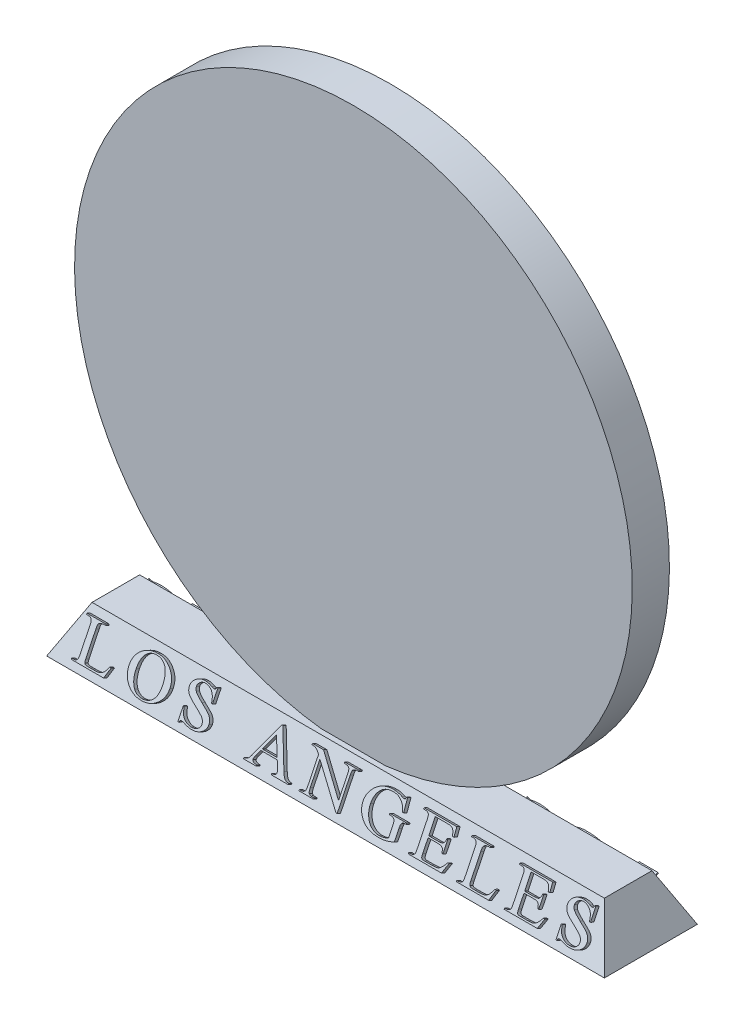
from build123d import *

# Parameters (mm, degrees)
SKETCH1_W                = 76.2
SKETCH1_H                = 12.7
BOSS_EXTRUDE1_DEPTH      = 6.35
BOSS_EXTRUDE1_TAPER      = 26
BOSS_EXTRUDE2_DEPTH      = 2.54
BOSS_EXTRUDE2_DEPTH_BACK = 2.54
SKETCH2_R                = 38.1
BOSS_EXTRUDE3_DEPTH      = 0.508
BOSS_EXTRUDE4_DEPTH      = 0.508


with BuildPart() as part:
    # Sketch1 → Boss-Extrude1 (new body)
    with BuildSketch(Plane(origin=(0, 0, 0), x_dir=(1, 0, 0), z_dir=(0, 1, 0))):
        Rectangle(SKETCH1_W, SKETCH1_H)
    extrude(amount=BOSS_EXTRUDE1_DEPTH, taper=BOSS_EXTRUDE1_TAPER)

    # Sketch2 → Boss-Extrude2 (add, two sides: drawn at the far end of the back side and taken through both)
    with BuildSketch(Plane.XY.offset(-BOSS_EXTRUDE2_DEPTH_BACK)):
        with Locations((0, 44.196)):
            Circle(SKETCH2_R)
    extrude(amount=BOSS_EXTRUDE2_DEPTH + BOSS_EXTRUDE2_DEPTH_BACK)

    # Sketch5 → Boss-Extrude3 (add)
    # profile 1 of 10: a face of its own
    with BuildSketch(Plane(origin=(0, 2.501934143, 5.129725184), x_dir=(1, 0, 0), z_dir=(0, 0.43837114678907857, 0.8987940462991666))):
        with BuildLine():
            Line((-30.09137008, -0.358568205), (-29.887535264, -0.382985918))
            Line((-29.887535264, -0.382985918), (-30.363149835, -1.649522042))
            Line((-30.363149835, -1.649522042), (-34.779570854, -1.649522042))
            Line((-34.779570854, -1.649522042), (-34.779570854, -1.513632164))
            Line((-34.779570854, -1.513632164), (-34.566181281, -1.513632164))
            add(Edge.make_bspline(
                [(-34.566181281, -1.513632164), (-34.537132568, -1.513085751), (-34.481342189, -1.51203632), (-34.400699961, -1.502218767), (-34.326299028, -1.486631504), (-34.258183356, -1.464523042), (-34.196327021, -1.435932196), (-34.142385777, -1.398820112), (-34.092343762, -1.358262752), (-34.065623287, -1.325174856), (-34.052347682, -1.308735708)],
                knots=[0, 0, 0, 0, 1.213917061, 2.331424934, 3.390511948, 4.386993121, 5.320069289, 6.226856332, 7.119044292, 8, 8, 8, 8], degree=3))
            add(Edge.make_bspline(
                [(-34.052347682, -1.308735708), (-34.045243977, -1.29760551), (-34.0294915, -1.272924275), (-34.012926128, -1.227959804), (-33.996214777, -1.174746406), (-33.985614592, -1.111132031), (-33.976182319, -1.038548833), (-33.968614195, -0.956049802), (-33.964572072, -0.864305028), (-33.964348325, -0.79986042), (-33.964231589, -0.766237838)],
                knots=[0, 0, 0, 0, 0.568455717, 1.260551537, 2.057912564, 2.974647128, 4.037526905, 5.218526386, 6.548826243, 8, 8, 8, 8], degree=3))
            Line((-33.964231589, -0.766237838), (-33.964231589, 2.359229345))
            add(Edge.make_bspline(
                [(-33.964231589, 2.359229345), (-33.964662103, 2.39639495), (-33.965478504, 2.466873613), (-33.970918152, 2.567439554), (-33.978760358, 2.65718167), (-33.991033846, 2.736067725), (-34.008254385, 2.803826942), (-34.02783702, 2.860885778), (-34.050432132, 2.908495498), (-34.071303152, 2.93285925), (-34.081011953, 2.944192802)],
                knots=[0, 0, 0, 0, 1.468663407, 2.785086748, 3.97904236, 5.027431138, 5.936438838, 6.736996147, 7.412474717, 8, 8, 8, 8], degree=3))
            add(Edge.make_bspline(
                [(-34.081011953, 2.944192802), (-34.110391233, 2.969488291), (-34.170883402, 3.021571902), (-34.286638441, 3.071565601), (-34.420296373, 3.100906891), (-34.515754658, 3.104647607), (-34.566181281, 3.106623671)],
                knots=[0, 0, 0, 0, 0.88284098, 1.817776533, 2.847222531, 4, 4, 4, 4], degree=3))
            Line((-34.566181281, 3.106623671), (-34.779570854, 3.106623671))
            Line((-34.779570854, 3.106623671), (-34.779570854, 3.242513549))
            Line((-34.779570854, 3.242513549), (-32.197663182, 3.242513549))
            Line((-32.197663182, 3.242513549), (-32.197663182, 3.106623671))
            add(Edge.make_bspline(
                [(-32.197663182, 3.106623671), (-32.234115738, 3.106893553), (-32.303852615, 3.107409859), (-32.404383954, 3.103880813), (-32.496075591, 3.098764099), (-32.579733277, 3.091714005), (-32.654806742, 3.081061389), (-32.721778965, 3.06841677), (-32.780652944, 3.054238807), (-32.8453139, 3.030399542), (-32.914077551, 2.996924905), (-32.985941288, 2.953216641), (-33.041670483, 2.901660648), (-33.078535278, 2.853188581), (-33.099753644, 2.807149918), (-33.113564965, 2.763003393), (-33.123023866, 2.708669798), (-33.133046327, 2.644694419), (-33.139993054, 2.570596672), (-33.145252079, 2.486337664), (-33.14834631, 2.392162731), (-33.148704602, 2.325966804), (-33.148892324, 2.291284406)],
                knots=[0, 0, 0, 0, 1.436844746, 2.748807598, 3.964455811, 5.056924761, 6.057146804, 6.951794349, 7.743507724, 8.440726119, 9.663636286, 10.754946778, 11.742145944, 12.640591973, 13.133599828, 13.733609822, 14.458604655, 15.304965432, 16.286332198, 17.390583233, 18.632833827, 20, 20, 20, 20], degree=3))
            Line((-33.148892324, 2.291284406), (-33.148892324, -0.870278525))
            add(Edge.make_bspline(
                [(-33.148892324, -0.870278525), (-33.148321307, -0.917763434), (-33.14727474, -1.004794433), (-33.134215821, -1.122818811), (-33.117110354, -1.218613631), (-33.093504289, -1.270804816), (-33.083070665, -1.293872753)],
                knots=[0, 0, 0, 0, 1.317399415, 2.414547887, 3.299247364, 4, 4, 4, 4], degree=3))
            add(Edge.make_bspline(
                [(-33.083070665, -1.293872753), (-33.074373664, -1.306353216), (-33.056750077, -1.331643604), (-33.02042158, -1.361773784), (-32.979658392, -1.389109566), (-32.938501198, -1.407877152), (-32.895504489, -1.418419727), (-32.849330506, -1.425462819), (-32.789800514, -1.431577827), (-32.716505414, -1.436717571), (-32.629426672, -1.440750386), (-32.528920858, -1.444212422), (-32.414942828, -1.444514701), (-32.334613681, -1.445281743), (-32.292149112, -1.445687225)],
                knots=[0, 0, 0, 0, 0.65288139, 1.322997731, 2.016825696, 2.767977, 3.256329581, 3.920867334, 4.779956306, 5.835212479, 7.087492647, 8.537304338, 10.169507812, 12, 12, 12, 12], degree=3))
            Line((-32.292149112, -1.445687225), (-31.886602759, -1.445687225))
            add(Edge.make_bspline(
                [(-31.886602759, -1.445687225), (-31.835285766, -1.445609994), (-31.736524798, -1.445461359), (-31.594606047, -1.440828228), (-31.464654042, -1.434950547), (-31.34671759, -1.425583767), (-31.240517799, -1.412821392), (-31.145956082, -1.39805246), (-31.063086793, -1.381898445), (-30.96876203, -1.35476177), (-30.861415582, -1.309621), (-30.739341738, -1.241693713), (-30.624075985, -1.15532517), (-30.512160029, -1.051154128), (-30.402990301, -0.922088592), (-30.298370853, -0.761781519), (-30.190328503, -0.572686146), (-30.125650029, -0.432740284), (-30.09137008, -0.358568205)],
                knots=[0, 0, 0, 0, 1.075442643, 2.069719036, 2.975646309, 3.801598266, 4.548586125, 5.216786471, 5.807332226, 6.316712193, 7.271188854, 8.240817338, 9.237635369, 10.281911908, 11.439530231, 12.770424646, 14.288307247, 16, 16, 16, 16], degree=3))
        make_face()
    # profile 2 of 10: a face of its own
    with BuildSketch(Plane(origin=(0, 2.501934143, 5.129725184), x_dir=(1, 0, 0), z_dir=(0, 0.43837114678907857, 0.8987940462991666))):
        with BuildLine():
            add(Edge.make_bspline(
                [(-25.118012891, 3.310458487), (-25.026948368, 3.308682498), (-24.847346835, 3.305179813), (-24.583173519, 3.269498515), (-24.328258561, 3.214953664), (-24.08241418, 3.137143193), (-23.846473354, 3.035587033), (-23.619102277, 2.913179959), (-23.401769959, 2.767919587), (-23.196685384, 2.602432204), (-23.007381099, 2.421505589), (-22.84027157, 2.227109891), (-22.701229596, 2.019621128), (-22.584508727, 1.803135745), (-22.496556314, 1.573789512), (-22.43275571, 1.334013712), (-22.393442477, 1.08301526), (-22.388781136, 0.912003027), (-22.386414026, 0.825160025)],
                knots=[0, 0, 0, 0, 1.063232074, 2.096953926, 3.108085754, 4.105639018, 5.103877308, 6.104552196, 7.118106487, 8.153034481, 9.179264924, 10.17335159, 11.141060677, 12.091629146, 13.040506146, 14.003151254, 14.985965281, 16, 16, 16, 16], degree=3))
            add(Edge.make_bspline(
                [(-22.386414026, 0.825160025), (-22.388730546, 0.735478882), (-22.393275691, 0.559519401), (-22.432998467, 0.301611394), (-22.49564017, 0.055123189), (-22.587624079, -0.178829691), (-22.702112661, -0.402529923), (-22.844903996, -0.613055786), (-23.011394723, -0.813246984), (-23.202940639, -0.997913812), (-23.41106756, -1.166403733), (-23.63228202, -1.314289791), (-23.86459381, -1.438700275), (-24.107498958, -1.541332255), (-24.3618835, -1.620029814), (-24.62665427, -1.675757797), (-24.902269424, -1.710869264), (-25.08959608, -1.715242269), (-25.184896191, -1.71746698)],
                knots=[0, 0, 0, 0, 1.020415007, 2.002112039, 2.963629454, 3.910047059, 4.857827076, 5.818770391, 6.799872043, 7.81697323, 8.842552559, 9.844832685, 10.841591728, 11.838244922, 12.842361358, 13.867988163, 14.915365445, 16, 16, 16, 16], degree=3))
            add(Edge.make_bspline(
                [(-25.184896191, -1.71746698), (-25.280918735, -1.7157447), (-25.469698229, -1.71235871), (-25.746401893, -1.67625376), (-26.012332715, -1.623800766), (-26.265634062, -1.545047872), (-26.508265325, -1.447187639), (-26.736939588, -1.323084864), (-26.956368362, -1.181055801), (-27.160369825, -1.016183109), (-27.347347839, -0.834718093), (-27.510484165, -0.637331519), (-27.64964177, -0.42734749), (-27.762939997, -0.203982979), (-27.850127517, 0.032376103), (-27.913014264, 0.281383872), (-27.95062912, 0.543739481), (-27.955444662, 0.723119073), (-27.957899003, 0.814543628)],
                knots=[0, 0, 0, 0, 1.096079162, 2.154882179, 3.182188919, 4.188375256, 5.179882818, 6.165374778, 7.155258099, 8.161436318, 9.156085865, 10.126409336, 11.080390582, 12.027566305, 12.980313799, 13.951781441, 14.95608265, 16, 16, 16, 16], degree=3))
            add(Edge.make_bspline(
                [(-27.957899003, 0.814543628), (-27.95748977, 0.861637998), (-27.956679208, 0.954917207), (-27.944062256, 1.093059963), (-27.926109232, 1.22801629), (-27.902385998, 1.360195467), (-27.868652634, 1.48851168), (-27.830067354, 1.613993967), (-27.782566102, 1.735693618), (-27.7290943, 1.854489062), (-27.666385516, 1.969290826), (-27.599435976, 2.082446875), (-27.522028591, 2.190251694), (-27.43939198, 2.296002352), (-27.348770151, 2.397542321), (-27.252014624, 2.497092748), (-27.146925427, 2.592223217), (-27.072765953, 2.652569698), (-27.035334132, 2.683029444)],
                knots=[0, 0, 0, 0, 1.044748662, 2.069320146, 3.075579323, 4.065992854, 5.046927029, 6.01809885, 6.977739683, 7.944200758, 8.906921484, 9.879330851, 10.859824821, 11.84961545, 12.856579216, 13.878408177, 14.929131505, 16, 16, 16, 16], degree=3))
            add(Edge.make_bspline(
                [(-27.035334132, 2.683029444), (-26.967943635, 2.733551564), (-26.833737503, 2.834164836), (-26.616830083, 2.960940343), (-26.390874754, 3.068721314), (-26.155322271, 3.156910554), (-25.91009313, 3.226597807), (-25.654566137, 3.274485694), (-25.389496478, 3.30550121), (-25.209402777, 3.308789712), (-25.118012891, 3.310458487)],
                knots=[0, 0, 0, 0, 0.982490949, 1.95660097, 2.926638505, 3.901807737, 4.88910646, 5.898547188, 6.933602165, 8, 8, 8, 8], degree=3))
        make_face()
        with BuildLine():
            add(Edge.make_bspline(
                [(-25.197635867, 3.106623671), (-25.259996339, 3.105344596), (-25.382343511, 3.102835134), (-25.560746303, 3.078826355), (-25.729649422, 3.040813913), (-25.88927834, 2.987656984), (-26.039327403, 2.918267668), (-26.180451957, 2.83434299), (-26.31119182, 2.73366974), (-26.389568699, 2.65627907), (-26.429137881, 2.617207784)],
                knots=[0, 0, 0, 0, 1.096644342, 2.151544546, 3.160465793, 4.138980089, 5.105637274, 6.063411535, 7.022298135, 8, 8, 8, 8], degree=3))
            add(Edge.make_bspline(
                [(-26.429137881, 2.617207784), (-26.475345767, 2.564417375), (-26.56852781, 2.457961126), (-26.686578787, 2.277807489), (-26.785121826, 2.079577532), (-26.86751335, 1.864340853), (-26.928867091, 1.630597659), (-26.9749705, 1.380156925), (-27.000929676, 1.11199455), (-27.004720323, 0.927485117), (-27.006669861, 0.832591502)],
                knots=[0, 0, 0, 0, 0.875574106, 1.765667961, 2.680969414, 3.636575662, 4.639171905, 5.695226342, 6.81464975, 8, 8, 8, 8], degree=3))
            add(Edge.make_bspline(
                [(-27.006669861, 0.832591502), (-27.004846484, 0.735207212), (-27.00129811, 0.545692971), (-26.973510047, 0.269891534), (-26.927609254, 0.011194379), (-26.861494171, -0.229961887), (-26.777991089, -0.454414104), (-26.674727421, -0.661310215), (-26.55274966, -0.851382336), (-26.455964731, -0.964032176), (-26.407905088, -1.019969719)],
                knots=[0, 0, 0, 0, 1.172529505, 2.281795537, 3.334169619, 4.332843966, 5.288979698, 6.213284834, 7.112786517, 8, 8, 8, 8], degree=3))
            add(Edge.make_bspline(
                [(-26.407905088, -1.019969719), (-26.36876571, -1.059477511), (-26.29142955, -1.137541626), (-26.161202988, -1.237678509), (-26.022520565, -1.323235598), (-25.874469411, -1.393471302), (-25.717150029, -1.448099933), (-25.550459311, -1.485643465), (-25.374935456, -1.509887635), (-25.254693242, -1.512367723), (-25.193389308, -1.513632164)],
                knots=[0, 0, 0, 0, 0.987410898, 1.951041879, 2.911033439, 3.878760291, 4.857318916, 5.864205841, 6.911093019, 8, 8, 8, 8], degree=3))
            add(Edge.make_bspline(
                [(-25.193389308, -1.513632164), (-25.127484519, -1.512069879), (-24.998348437, -1.509008684), (-24.809146865, -1.482919177), (-24.629080049, -1.440187969), (-24.456897786, -1.382524013), (-24.295003618, -1.304742338), (-24.140518903, -1.212401533), (-23.996401967, -1.100745969), (-23.859521023, -0.974872608), (-23.735219143, -0.829673271), (-23.62794297, -0.663886522), (-23.5372542, -0.478530709), (-23.464728179, -0.273440374), (-23.407717933, -0.049528932), (-23.366594602, 0.193637665), (-23.342427351, 0.456280427), (-23.339272835, 0.637905625), (-23.337643168, 0.731735734)],
                knots=[0, 0, 0, 0, 0.956915321, 1.875012395, 2.76766422, 3.642151523, 4.506642272, 5.371392746, 6.251391293, 7.149707621, 8.068480681, 9.019386056, 10.010131348, 11.058795331, 12.17330045, 13.362230799, 14.637291668, 16, 16, 16, 16], degree=3))
            add(Edge.make_bspline(
                [(-23.337643168, 0.731735734), (-23.338923823, 0.833731932), (-23.341401332, 1.031050103), (-23.370329903, 1.316825802), (-23.413124964, 1.583139067), (-23.477447183, 1.829038276), (-23.556924959, 2.056135578), (-23.658183108, 2.261665075), (-23.773140967, 2.450515772), (-23.868272211, 2.559318019), (-23.915175148, 2.612961225)],
                knots=[0, 0, 0, 0, 1.214926082, 2.350352211, 3.419342494, 4.425761161, 5.375445996, 6.280698379, 7.152325864, 8, 8, 8, 8], degree=3))
            add(Edge.make_bspline(
                [(-23.915175148, 2.612961225), (-23.954579364, 2.652584703), (-24.033056944, 2.731498964), (-24.16772361, 2.831271276), (-24.312444101, 2.916148045), (-24.467882344, 2.987419073), (-24.634810804, 3.040930466), (-24.812650822, 3.078867125), (-25.001279138, 3.102955203), (-25.131030847, 3.105379311), (-25.197635867, 3.106623671)],
                knots=[0, 0, 0, 0, 0.946831797, 1.885713629, 2.832906932, 3.789281889, 4.78024408, 5.79991913, 6.870639694, 8, 8, 8, 8], degree=3))
        make_face(mode=Mode.SUBTRACT)
    # profile 3 of 10: a face of its own
    with BuildSketch(Plane(origin=(0, 2.501934143, 5.129725184), x_dir=(1, 0, 0), z_dir=(0, 0.43837114678907857, 0.8987940462991666))):
        with BuildLine():
            Line((-16.92364095, 3.310458487), (-16.92364095, 1.611835019))
            Line((-16.92364095, 1.611835019), (-17.059530827, 1.611835019))
            add(Edge.make_bspline(
                [(-17.059530827, 1.611835019), (-17.071836917, 1.694223907), (-17.095320368, 1.851444889), (-17.152279693, 2.071834709), (-17.220065977, 2.266736573), (-17.303831171, 2.437378965), (-17.405092159, 2.586320179), (-17.524847318, 2.717784931), (-17.66367504, 2.833072271), (-17.820201031, 2.929329135), (-17.986488583, 3.006860989), (-18.157538038, 3.066058912), (-18.332926792, 3.099177248), (-18.450859715, 3.104144213), (-18.509730614, 3.106623671)],
                knots=[0, 0, 0, 0, 1.301375599, 2.483387653, 3.552449801, 4.522213541, 5.445868674, 6.358274036, 7.293190861, 8.257178709, 9.222308647, 10.156439608, 11.079713671, 12, 12, 12, 12], degree=3))
            add(Edge.make_bspline(
                [(-18.509730614, 3.106623671), (-18.542689289, 3.106263427), (-18.607061031, 3.105559833), (-18.701328177, 3.092665397), (-18.791420297, 3.075561282), (-18.877279256, 3.049428017), (-18.959004637, 3.017084084), (-19.035646666, 2.975971838), (-19.108907755, 2.929422622), (-19.175639636, 2.874305219), (-19.236580722, 2.81561792), (-19.290597953, 2.754467726), (-19.336186351, 2.691397014), (-19.372997181, 2.625358818), (-19.401227633, 2.557545338), (-19.423463167, 2.488171237), (-19.434841096, 2.416225979), (-19.436677376, 2.367755557), (-19.437603684, 2.34330475)],
                knots=[0, 0, 0, 0, 1.186847675, 2.318037672, 3.423698156, 4.489041087, 5.54779689, 6.586227407, 7.619317299, 8.671135421, 9.699489964, 10.666614379, 11.608167, 12.498930823, 13.384933127, 14.252378353, 15.118415769, 16, 16, 16, 16], degree=3))
            add(Edge.make_bspline(
                [(-19.437603684, 2.34330475), (-19.436070113, 2.305881018), (-19.433035349, 2.231823663), (-19.399101832, 2.12454165), (-19.350268589, 2.02098935), (-19.301967963, 1.960277023), (-19.277296094, 1.929265279)],
                knots=[0, 0, 0, 0, 0.987122292, 1.953403987, 2.954602578, 4, 4, 4, 4], degree=3))
            add(Edge.make_bspline(
                [(-19.277296094, 1.929265279), (-19.255073509, 1.905118549), (-19.206340024, 1.852165469), (-19.116834301, 1.776073775), (-19.009883345, 1.691333992), (-18.880391568, 1.604650274), (-18.732712086, 1.509714251), (-18.565082118, 1.40946569), (-18.377790441, 1.302697013), (-18.244884604, 1.23244577), (-18.175314118, 1.195672269)],
                knots=[0, 0, 0, 0, 0.591886256, 1.297989435, 2.11710547, 3.054430298, 4.108787091, 5.286494208, 6.579596515, 8, 8, 8, 8], degree=3))
            add(Edge.make_bspline(
                [(-18.175314118, 1.195672269), (-18.118287737, 1.165689686), (-18.008288808, 1.107855893), (-17.849928662, 1.022585766), (-17.703562275, 0.943347592), (-17.570251423, 0.869189437), (-17.449567054, 0.800901774), (-17.341236342, 0.738326603), (-17.245281134, 0.681425871), (-17.135227137, 0.61439506), (-17.013347359, 0.530773795), (-16.883587744, 0.42175355), (-16.773581779, 0.301536059), (-16.681085032, 0.174513768), (-16.607044606, 0.04181532), (-16.554418876, -0.095375234), (-16.52232443, -0.236063816), (-16.518090078, -0.33115711), (-16.515971317, -0.378739359)],
                knots=[0, 0, 0, 0, 1.282192731, 2.473238241, 3.579386958, 4.59451007, 5.509109487, 6.33898068, 7.08420769, 7.729218448, 8.903340578, 10.022439401, 11.094060814, 12.137922343, 13.143472544, 14.108730405, 15.053657117, 16, 16, 16, 16], degree=3))
            add(Edge.make_bspline(
                [(-16.515971317, -0.378739359), (-16.517285621, -0.423783182), (-16.519880904, -0.512728723), (-16.543992823, -0.64337089), (-16.583871788, -0.768591113), (-16.638242477, -0.889681645), (-16.70927721, -1.005623522), (-16.794468859, -1.117816106), (-16.896269006, -1.224216169), (-17.012455558, -1.324054116), (-17.14018871, -1.415924603), (-17.277679626, -1.497411091), (-17.424964831, -1.564919352), (-17.580331688, -1.621579651), (-17.744857404, -1.665121862), (-17.918168484, -1.695554134), (-18.100609903, -1.71375223), (-18.225168906, -1.716209513), (-18.288909563, -1.71746698)],
                knots=[0, 0, 0, 0, 0.875827913, 1.729448819, 2.574416335, 3.428092785, 4.305516285, 5.214472075, 6.164242626, 7.165059746, 8.191256522, 9.22222435, 10.269685789, 11.339208542, 12.436564627, 13.576580464, 14.759862007, 16, 16, 16, 16], degree=3))
            add(Edge.make_bspline(
                [(-18.288909563, -1.71746698), (-18.368276798, -1.716034841), (-18.522410343, -1.713253583), (-18.675433493, -1.69464456), (-18.749661179, -1.68561779)],
                knots=[0, 0, 0, 0, 1.029850247, 2, 2, 2, 2], degree=3))
            add(Edge.make_bspline(
                [(-18.749661179, -1.68561779), (-18.76169391, -1.68350098), (-18.788970103, -1.678702523), (-18.834068168, -1.67060022), (-18.887778562, -1.658453785), (-18.949945781, -1.64346326), (-19.02123993, -1.626787041), (-19.101130325, -1.606250911), (-19.189702908, -1.583268615), (-19.283675976, -1.55719722), (-19.37684512, -1.531113537), (-19.464067377, -1.509071444), (-19.541880489, -1.489795886), (-19.610404969, -1.473565559), (-19.669986281, -1.462014077), (-19.71987489, -1.453436039), (-19.760567767, -1.447544881), (-19.784746911, -1.446254491), (-19.795376252, -1.445687225)],
                knots=[0, 0, 0, 0, 0.546066848, 1.237842335, 2.047574133, 3.006653391, 4.096149772, 5.319852814, 6.693241156, 8.185860374, 9.678479592, 11.017279831, 12.20645868, 13.261544264, 14.164188396, 14.918250996, 15.524454694, 16, 16, 16, 16], degree=3))
            add(Edge.make_bspline(
                [(-19.795376252, -1.445687225), (-19.811687364, -1.44629767), (-19.843197031, -1.447476923), (-19.888119251, -1.456463858), (-19.927189073, -1.474093614), (-19.962229099, -1.498210052), (-19.991827375, -1.533860054), (-20.014621607, -1.583424288), (-20.035846417, -1.645154119), (-20.044468707, -1.692169339), (-20.049108132, -1.71746698)],
                knots=[0, 0, 0, 0, 0.939842004, 1.815578742, 2.618774197, 3.393787768, 4.247411227, 5.250369966, 6.520497133, 8, 8, 8, 8], degree=3))
            Line((-20.049108132, -1.71746698), (-20.18499801, -1.71746698))
            Line((-20.18499801, -1.71746698), (-20.18499801, -0.018843512))
            Line((-20.18499801, -0.018843512), (-20.049108132, -0.018843512))
            add(Edge.make_bspline(
                [(-20.049108132, -0.018843512), (-20.040207246, -0.064557527), (-20.022971658, -0.153077689), (-19.992983413, -0.280837244), (-19.96155121, -0.399584502), (-19.927341471, -0.509298913), (-19.891845288, -0.610665568), (-19.851979891, -0.702614873), (-19.812591109, -0.787144056), (-19.753887701, -0.886876968), (-19.667283114, -1.001148349), (-19.54207566, -1.125109543), (-19.392367899, -1.23560177), (-19.223047064, -1.333170474), (-19.037452081, -1.413930842), (-18.839678064, -1.470621871), (-18.633527725, -1.507267185), (-18.49290148, -1.511491005), (-18.421614521, -1.513632164)],
                knots=[0, 0, 0, 0, 0.912869306, 1.767670999, 2.572005186, 3.320205938, 4.020156707, 4.675988478, 5.284115374, 5.846868896, 6.941532479, 8.084456076, 9.288721689, 10.578520481, 11.908401432, 13.245301891, 14.603574688, 16, 16, 16, 16], degree=3))
            add(Edge.make_bspline(
                [(-18.421614521, -1.513632164), (-18.380550116, -1.512650176), (-18.3007603, -1.510742132), (-18.184215205, -1.500762644), (-18.074824322, -1.480922215), (-17.971018444, -1.456445728), (-17.874542814, -1.421605458), (-17.783379892, -1.382221324), (-17.700595382, -1.332386001), (-17.62367863, -1.277597741), (-17.555741188, -1.216362146), (-17.495675787, -1.152698159), (-17.445229771, -1.08610151), (-17.403184911, -1.017027037), (-17.371600723, -0.944296676), (-17.347651577, -0.869396299), (-17.333521318, -0.791545589), (-17.332050641, -0.7386911), (-17.331310582, -0.712094215)],
                knots=[0, 0, 0, 0, 1.309020562, 2.543480402, 3.722714709, 4.849664237, 5.937563344, 6.987625321, 8.008887756, 9.010532883, 9.993010597, 10.918627914, 11.796064559, 12.650960475, 13.489179023, 14.316707518, 15.152951103, 16, 16, 16, 16], degree=3))
            add(Edge.make_bspline(
                [(-17.331310582, -0.712094215), (-17.332488713, -0.681901994), (-17.334884549, -0.620503368), (-17.356456298, -0.52884464), (-17.389556293, -0.436916559), (-17.435962171, -0.345068136), (-17.494786817, -0.253530024), (-17.570944696, -0.166315714), (-17.659757617, -0.08071185), (-17.728090424, -0.030120871), (-17.763397927, -0.003980556)],
                knots=[0, 0, 0, 0, 0.840237003, 1.708698323, 2.610121636, 3.558227958, 4.570177854, 5.633295644, 6.777125884, 8, 8, 8, 8], degree=3))
            add(Edge.make_bspline(
                [(-17.763397927, -0.003980556), (-17.778157199, 0.006439483), (-17.812656784, 0.030796173), (-17.874301654, 0.067877095), (-17.950850984, 0.113923509), (-18.043550912, 0.167083511), (-18.152562662, 0.226936286), (-18.276944749, 0.295222449), (-18.417177031, 0.370428984), (-18.568946524, 0.451198636), (-18.724551256, 0.531858728), (-18.872772986, 0.613909015), (-19.013160799, 0.687594807), (-19.141475406, 0.761267207), (-19.261423064, 0.827266168), (-19.371328205, 0.889945418), (-19.470464509, 0.94981132), (-19.58922051, 1.01969603), (-19.721151392, 1.107797849), (-19.860679871, 1.221014599), (-19.979895909, 1.339532673), (-20.079455418, 1.463494515), (-20.156970019, 1.594239316), (-20.212697723, 1.731126238), (-20.247369177, 1.874822159), (-20.251068142, 1.972952557), (-20.252942949, 2.02268957)],
                knots=[0, 0, 0, 0, 0.388035065, 0.907026351, 1.544610361, 2.307497474, 3.202485834, 4.216383312, 5.35589903, 6.621078427, 7.909974931, 9.121071269, 10.260586986, 11.315827884, 12.299428722, 13.201877591, 14.033738013, 14.787363345, 16.162188992, 17.437447665, 18.641651841, 19.76726039, 20.844268949, 21.894651071, 22.932912036, 24, 24, 24, 24], degree=3))
            add(Edge.make_bspline(
                [(-20.252942949, 2.02268957), (-20.251483191, 2.065952768), (-20.248605529, 2.151238783), (-20.226588049, 2.277076647), (-20.190764872, 2.398445425), (-20.139093198, 2.514720602), (-20.073732136, 2.626315396), (-19.993285913, 2.732542956), (-19.899213086, 2.835033708), (-19.791658336, 2.931898788), (-19.672555111, 3.020371923), (-19.544568288, 3.098073209), (-19.409160948, 3.164761089), (-19.26495381, 3.216981262), (-19.113724396, 3.260315764), (-18.954090603, 3.289562307), (-18.78683004, 3.306416913), (-18.672908047, 3.309093843), (-18.614832941, 3.310458487)],
                knots=[0, 0, 0, 0, 0.896593267, 1.767480703, 2.640313085, 3.514162522, 4.398787781, 5.315920006, 6.271429188, 7.279253601, 8.312320719, 9.342883555, 10.379799593, 11.436055644, 12.518464406, 13.638033074, 14.795917503, 16, 16, 16, 16], degree=3))
            add(Edge.make_bspline(
                [(-18.614832941, 3.310458487), (-18.539344185, 3.308003944), (-18.385170193, 3.302990921), (-18.15116923, 3.267746953), (-17.910894203, 3.208877494), (-17.751675643, 3.153929436), (-17.669973636, 3.125733185)],
                knots=[0, 0, 0, 0, 0.93611779, 1.911874342, 2.928491402, 4, 4, 4, 4], degree=3))
            add(Edge.make_bspline(
                [(-17.669973636, 3.125733185), (-17.634384611, 3.112500546), (-17.569706322, 3.088451997), (-17.479453481, 3.062322091), (-17.406784528, 3.042830887), (-17.362886424, 3.03992543), (-17.344050258, 3.038678732)],
                knots=[0, 0, 0, 0, 1.34479119, 2.443977909, 3.332329001, 4, 4, 4, 4], degree=3))
            add(Edge.make_bspline(
                [(-17.344050258, 3.038678732), (-17.327002227, 3.039153295), (-17.293959524, 3.040073099), (-17.24698549, 3.051017296), (-17.204968157, 3.068045054), (-17.16661517, 3.09196835), (-17.133763999, 3.128474591), (-17.104447587, 3.176635297), (-17.079001128, 3.238724487), (-17.066397914, 3.28515823), (-17.059530827, 3.310458487)],
                knots=[0, 0, 0, 0, 0.941587506, 1.82499638, 2.650305386, 3.443162258, 4.301929371, 5.339574234, 6.550419339, 8, 8, 8, 8], degree=3))
            Line((-17.059530827, 3.310458487), (-16.92364095, 3.310458487))
        make_face()
    # profile 4 of 10: a face of its own
    with BuildSketch(Plane(origin=(0, 2.501934143, 5.129725184), x_dir=(1, 0, 0), z_dir=(0, 0.43837114678907857, 0.8987940462991666))):
        with BuildLine():
            Line((-7.352747015, -0.018843512), (-9.595991633, -0.018843512))
            Line((-9.595991633, -0.018843512), (-10.006846185, -0.789593911))
            add(Edge.make_bspline(
                [(-10.006846185, -0.789593911), (-10.028453936, -0.833169441), (-10.068148999, -0.913220963), (-10.112588594, -1.02755921), (-10.143934764, -1.123785702), (-10.148262383, -1.183649332), (-10.15016754, -1.210003219)],
                knots=[0, 0, 0, 0, 1.303654032, 2.394910346, 3.293388121, 4, 4, 4, 4], degree=3))
            add(Edge.make_bspline(
                [(-10.15016754, -1.210003219), (-10.148863569, -1.228333808), (-10.146245091, -1.265143106), (-10.119960249, -1.317349721), (-10.079804902, -1.365085444), (-10.034623638, -1.401500628), (-9.988259899, -1.427403307), (-9.943189634, -1.44505462), (-9.889569065, -1.460987639), (-9.826620972, -1.47428236), (-9.754707311, -1.486738901), (-9.674117713, -1.498939627), (-9.584373109, -1.506652214), (-9.521680035, -1.511229224), (-9.488766027, -1.513632164)],
                knots=[0, 0, 0, 0, 0.826484043, 1.65964654, 2.59498212, 3.645576003, 4.270898893, 4.998353688, 5.83645166, 6.806420914, 7.915033129, 9.147930993, 10.502657203, 12, 12, 12, 12], degree=3))
            Line((-9.488766027, -1.513632164), (-9.488766027, -1.649522042))
            Line((-9.488766027, -1.649522042), (-11.251087876, -1.649522042))
            Line((-11.251087876, -1.649522042), (-11.251087876, -1.513632164))
            add(Edge.make_bspline(
                [(-11.251087876, -1.513632164), (-11.196436791, -1.50442044), (-11.097158273, -1.487686529), (-10.96479348, -1.455686912), (-10.862291261, -1.420038376), (-10.809730132, -1.385996071), (-10.787151341, -1.371372449)],
                knots=[0, 0, 0, 0, 1.358718194, 2.46823147, 3.341995052, 4, 4, 4, 4], degree=3))
            add(Edge.make_bspline(
                [(-10.787151341, -1.371372449), (-10.768830541, -1.35502102), (-10.729949107, -1.320319095), (-10.674179603, -1.259313797), (-10.616170727, -1.187740685), (-10.558795539, -1.103419548), (-10.498109331, -1.009199013), (-10.436479852, -0.903651763), (-10.373987387, -0.786527564), (-10.332915434, -0.704060861), (-10.311536769, -0.661135511)],
                knots=[0, 0, 0, 0, 0.684762061, 1.453240676, 2.302870373, 3.253285412, 4.296788501, 5.429651999, 6.662089249, 8, 8, 8, 8], degree=3))
            Line((-10.311536769, -0.661135511), (-8.193565632, 3.310458487))
            Line((-8.193565632, 3.310458487), (-8.048120997, 3.310458487))
            Line((-8.048120997, 3.310458487), (-6.133984676, -0.721648972))
            add(Edge.make_bspline(
                [(-6.133984676, -0.721648972), (-6.114338746, -0.76030985), (-6.07661386, -0.834547984), (-6.019321702, -0.940491468), (-5.962450109, -1.035300864), (-5.907067691, -1.119504891), (-5.854215918, -1.193353047), (-5.802235398, -1.256300917), (-5.751415158, -1.308903835), (-5.683680279, -1.365244376), (-5.589373405, -1.42087602), (-5.46013042, -1.468126377), (-5.312705934, -1.501234558), (-5.207358018, -1.509359969), (-5.151967983, -1.513632164)],
                knots=[0, 0, 0, 0, 1.157210189, 2.222120407, 3.213254973, 4.106377063, 4.911049039, 5.635290142, 6.283029777, 6.859763139, 7.982078448, 9.183486191, 10.519127789, 12, 12, 12, 12], degree=3))
            Line((-5.151967983, -1.513632164), (-5.151967983, -1.649522042))
            Line((-5.151967983, -1.649522042), (-7.445109666, -1.649522042))
            Line((-7.445109666, -1.649522042), (-7.445109666, -1.513632164))
            add(Edge.make_bspline(
                [(-7.445109666, -1.513632164), (-7.392630327, -1.510761599), (-7.296434135, -1.505499767), (-7.166758344, -1.484284294), (-7.063229272, -1.457679484), (-6.985631733, -1.419337609), (-6.931065286, -1.372034724), (-6.891813366, -1.322313273), (-6.867357648, -1.26654012), (-6.864683158, -1.227576939), (-6.863331128, -1.20787994)],
                knots=[0, 0, 0, 0, 1.73849277, 3.186709115, 4.343637046, 5.265721361, 6.021722471, 6.715242394, 7.350518385, 8, 8, 8, 8], degree=3))
            add(Edge.make_bspline(
                [(-6.863331128, -1.20787994), (-6.865864215, -1.176557185), (-6.871630736, -1.105251597), (-6.907979503, -0.988937386), (-6.959292283, -0.848388139), (-7.006414765, -0.749225783), (-7.032131835, -0.69510798)],
                knots=[0, 0, 0, 0, 0.692488186, 1.576434712, 2.677340549, 4, 4, 4, 4], degree=3))
            Line((-7.032131835, -0.69510798), (-7.352747015, -0.018843512))
        make_face()
        Polygon((-7.449356224, 0.184991305), (-8.410140124, 2.149024691), (-9.486642747, 0.184991305), align=None, mode=Mode.SUBTRACT)
    # profile 5 of 10: a face of its own
    with BuildSketch(Plane(origin=(0, 2.501934143, 5.129725184), x_dir=(1, 0, 0), z_dir=(0, 0.43837114678907857, 0.8987940462991666))):
        with BuildLine():
            Line((-3.970787688, 3.242513549), (-2.451581323, 3.242513549))
            Line((-2.451581323, 3.242513549), (1.231246685, -0.498704642))
            Line((1.231246685, -0.498704642), (1.231246685, 2.359229345))
            add(Edge.make_bspline(
                [(1.231246685, 2.359229345), (1.230766552, 2.396743768), (1.229855593, 2.467920153), (1.225054747, 2.569293078), (1.215239075, 2.659575038), (1.203452285, 2.739257519), (1.186200499, 2.8077014), (1.166871729, 2.865470625), (1.142788395, 2.912489207), (1.121975403, 2.93706538), (1.112343042, 2.948439361)],
                knots=[0, 0, 0, 0, 1.471026375, 2.790988876, 3.976968255, 5.030839545, 5.946178082, 6.740461553, 7.417079057, 8, 8, 8, 8], degree=3))
            add(Edge.make_bspline(
                [(1.112343042, 2.948439361), (1.083287218, 2.97302701), (1.022745873, 3.024258369), (0.905451637, 3.072812172), (0.767770907, 3.102403741), (0.668409917, 3.105157284), (0.615495678, 3.106623671)],
                knots=[0, 0, 0, 0, 0.85049973, 1.772119622, 2.813552511, 4, 4, 4, 4], degree=3))
            Line((0.615495678, 3.106623671), (0.41590742, 3.106623671))
            Line((0.41590742, 3.106623671), (0.41590742, 3.242513549))
            Line((0.41590742, 3.242513549), (2.386310644, 3.242513549))
            Line((2.386310644, 3.242513549), (2.386310644, 3.106623671))
            Line((2.386310644, 3.106623671), (2.182475828, 3.106623671))
            add(Edge.make_bspline(
                [(2.182475828, 3.106623671), (2.153067378, 3.106109502), (2.096560247, 3.105121548), (2.015015125, 3.094872043), (1.939775655, 3.080915426), (1.871080514, 3.05941644), (1.809021601, 3.032229231), (1.754127797, 2.997294576), (1.704821917, 2.957653892), (1.677747345, 2.92588633), (1.66439567, 2.910220333)],
                knots=[0, 0, 0, 0, 1.229314859, 2.362078101, 3.433209679, 4.425673507, 5.36646248, 6.257622186, 7.140756043, 8, 8, 8, 8], degree=3))
            add(Edge.make_bspline(
                [(1.66439567, 2.910220333), (1.656452638, 2.898810575), (1.639308605, 2.874184053), (1.622986129, 2.827842909), (1.60473549, 2.773894434), (1.593789218, 2.709037779), (1.581984988, 2.635257176), (1.577425781, 2.551743413), (1.57068223, 2.458769946), (1.570871615, 2.393573355), (1.570971379, 2.359229345)],
                knots=[0, 0, 0, 0, 0.58693834, 1.266832387, 2.068883201, 3.001754031, 4.047941646, 5.236780056, 6.544401579, 8, 8, 8, 8], degree=3))
            Line((1.570971379, 2.359229345), (1.570971379, -1.728083377))
            Line((1.570971379, -1.728083377), (1.431896582, -1.728083377))
            Line((1.431896582, -1.728083377), (-2.505724946, 2.221216188))
            Line((-2.505724946, 2.221216188), (-2.505724946, -0.766237838))
            add(Edge.make_bspline(
                [(-2.505724946, -0.766237838), (-2.505294075, -0.803757945), (-2.50447658, -0.874945112), (-2.499052747, -0.976210781), (-2.491258789, -1.066690428), (-2.478467592, -1.146056791), (-2.463199879, -1.214910826), (-2.443169944, -1.27217373), (-2.420499811, -1.319405048), (-2.400362121, -1.344065965), (-2.391067862, -1.355447854)],
                knots=[0, 0, 0, 0, 1.474632325, 2.797830471, 3.98533307, 5.041787731, 5.956096168, 6.752326678, 7.424154466, 8, 8, 8, 8], degree=3))
            add(Edge.make_bspline(
                [(-2.391067862, -1.355447854), (-2.361649845, -1.380044484), (-2.300339575, -1.431306472), (-2.18264435, -1.479438896), (-2.045469642, -1.509496068), (-1.946790571, -1.51219457), (-1.894220497, -1.513632164)],
                knots=[0, 0, 0, 0, 0.857276722, 1.786655679, 2.820867756, 4, 4, 4, 4], degree=3))
            Line((-1.894220497, -1.513632164), (-1.690385681, -1.513632164))
            Line((-1.690385681, -1.513632164), (-1.690385681, -1.649522042))
            Line((-1.690385681, -1.649522042), (-3.660788905, -1.649522042))
            Line((-3.660788905, -1.649522042), (-3.660788905, -1.513632164))
            Line((-3.660788905, -1.513632164), (-3.461200647, -1.513632164))
            add(Edge.make_bspline(
                [(-3.461200647, -1.513632164), (-3.431441161, -1.513107257), (-3.374233935, -1.512098218), (-3.291943775, -1.502022117), (-3.21609612, -1.487705293), (-3.14686741, -1.46671146), (-3.084413051, -1.43889804), (-3.028740505, -1.404658107), (-2.979324379, -1.364622627), (-2.952233599, -1.332881692), (-2.938873931, -1.317228826)],
                knots=[0, 0, 0, 0, 1.235427638, 2.374886015, 3.438545254, 4.438124195, 5.372350114, 6.269777218, 7.14675023, 8, 8, 8, 8], degree=3))
            add(Edge.make_bspline(
                [(-2.938873931, -1.317228826), (-2.931031484, -1.305779099), (-2.914027442, -1.280953729), (-2.895794091, -1.2353292), (-2.879768933, -1.180616819), (-2.867997433, -1.116112299), (-2.856925642, -1.042186588), (-2.850056325, -0.958858099), (-2.845703981, -0.865726693), (-2.84553741, -0.800570302), (-2.84544964, -0.766237838)],
                knots=[0, 0, 0, 0, 0.586801679, 1.272307077, 2.069808948, 3.002462571, 4.048406594, 5.238198348, 6.544740497, 8, 8, 8, 8], degree=3))
            Line((-2.84544964, -0.766237838), (-2.84544964, 2.563064161))
            add(Edge.make_bspline(
                [(-2.84544964, 2.563064161), (-2.884036671, 2.604092477), (-2.955032889, 2.679580413), (-3.057225302, 2.778572061), (-3.143455123, 2.855910949), (-3.220562268, 2.913862176), (-3.298586157, 2.957602699), (-3.385475342, 2.998096684), (-3.487261973, 3.037185722), (-3.561187684, 3.059690369), (-3.600275444, 3.071589562)],
                knots=[0, 0, 0, 0, 1.459141082, 2.684671425, 3.685228739, 4.459128146, 5.177887487, 5.998245125, 6.941584559, 8, 8, 8, 8], degree=3))
            add(Edge.make_bspline(
                [(-3.600275444, 3.071589562), (-3.623212639, 3.076880442), (-3.674007014, 3.088597086), (-3.758862423, 3.099689887), (-3.859581466, 3.105581901), (-3.931851885, 3.106258924), (-3.970787688, 3.106623671)],
                knots=[0, 0, 0, 0, 0.756751447, 1.675824647, 2.747846822, 4, 4, 4, 4], degree=3))
            Line((-3.970787688, 3.106623671), (-3.970787688, 3.242513549))
        make_face()
    # profile 6 of 10: a face of its own
    with BuildSketch(Plane(origin=(0, 2.501934143, 5.129725184), x_dir=(1, 0, 0), z_dir=(0, 0.43837114678907857, 0.8987940462991666))):
        with BuildLine():
            Line((9.004147679, 3.310458487), (9.140037556, 1.747724896))
            Line((9.140037556, 1.747724896), (9.004147679, 1.747724896))
            add(Edge.make_bspline(
                [(9.004147679, 1.747724896), (8.985689946, 1.797182606), (8.949674181, 1.893687265), (8.885906328, 2.030786276), (8.820185271, 2.159414302), (8.752054281, 2.279905654), (8.677305815, 2.389557311), (8.598244448, 2.489314917), (8.517188527, 2.581719053), (8.457902471, 2.636105146), (8.428738979, 2.66285829)],
                knots=[0, 0, 0, 0, 1.159735093, 2.262940225, 3.32031861, 4.334156477, 5.30268541, 6.233087901, 7.130835619, 8, 8, 8, 8], degree=3))
            add(Edge.make_bspline(
                [(8.428738979, 2.66285829), (8.385536681, 2.698443687), (8.29941927, 2.76937793), (8.157868251, 2.859745979), (8.007727382, 2.936203155), (7.848715586, 2.999621472), (7.679791389, 3.046601188), (7.502464987, 3.082108526), (7.315881418, 3.101947696), (7.188787802, 3.10504459), (7.123983827, 3.106623671)],
                knots=[0, 0, 0, 0, 0.952613787, 1.898895175, 2.853128326, 3.819034777, 4.809214532, 5.835232225, 6.896202958, 8, 8, 8, 8], degree=3))
            add(Edge.make_bspline(
                [(7.123983827, 3.106623671), (7.03608966, 3.104545141), (6.86487531, 3.100496248), (6.616342043, 3.064323823), (6.383458958, 3.008123386), (6.166924343, 2.926453268), (5.966053143, 2.82290035), (5.782982188, 2.693138418), (5.614400549, 2.542736863), (5.518386725, 2.425702741), (5.469949224, 2.366660822)],
                knots=[0, 0, 0, 0, 1.120670835, 2.183022339, 3.196903709, 4.171218612, 5.128313044, 6.071389604, 7.027045653, 8, 8, 8, 8], degree=3))
            add(Edge.make_bspline(
                [(5.469949224, 2.366660822), (5.431894285, 2.313827695), (5.3562918, 2.20886587), (5.259012548, 2.041034246), (5.178994796, 1.865188511), (5.111121987, 1.682752609), (5.059365556, 1.49224074), (5.022496732, 1.294490465), (4.999445237, 1.089346166), (4.99676181, 0.95014109), (4.995396292, 0.879303648)],
                knots=[0, 0, 0, 0, 0.982601627, 1.952102092, 2.92264716, 3.896260676, 4.887768939, 5.898931565, 6.930826971, 8, 8, 8, 8], degree=3))
            add(Edge.make_bspline(
                [(4.995396292, 0.879303648), (4.996458213, 0.821586834), (4.998559513, 0.707378319), (5.014059137, 0.537962134), (5.037831544, 0.372226861), (5.073423693, 0.210329167), (5.11787896, 0.052162871), (5.171812405, -0.102389144), (5.237340344, -0.252327044), (5.310691862, -0.398100688), (5.393671379, -0.536706873), (5.482308341, -0.667083528), (5.577147211, -0.787919313), (5.678631063, -0.898613002), (5.785387333, -1.000949704), (5.899708444, -1.092513155), (6.019826541, -1.174237662), (6.145109691, -1.246660624), (6.274738666, -1.308170533), (6.404604561, -1.364125583), (6.536210081, -1.409298961), (6.667648685, -1.448467929), (6.800960519, -1.476428443), (6.934804546, -1.498068428), (7.069580243, -1.511135255), (7.159698346, -1.512800957), (7.204668441, -1.513632164)],
                knots=[0, 0, 0, 0, 1.142050567, 2.259859677, 3.364161358, 4.453438434, 5.53757057, 6.61400753, 7.689897613, 8.773554645, 9.841276855, 10.884370304, 11.891704893, 12.878155353, 13.854008724, 14.815380953, 15.772996259, 16.726762717, 17.675812442, 18.611015043, 19.523523222, 20.427770796, 21.323353089, 22.2167971, 23.110158767, 24, 24, 24, 24], degree=3))
            add(Edge.make_bspline(
                [(7.204668441, -1.513632164), (7.257425704, -1.512856448), (7.362033639, -1.511318346), (7.517189177, -1.497799863), (7.669667512, -1.47806453), (7.819578555, -1.4491807), (7.967142368, -1.412301936), (8.11178616, -1.365984318), (8.254185334, -1.313558819), (8.346507918, -1.272116609), (8.39264323, -1.251407166)],
                knots=[0, 0, 0, 0, 1.032203358, 2.046669178, 3.045653334, 4.0398254, 5.032452669, 6.020212606, 7.01066343, 8, 8, 8, 8], degree=3))
            Line((8.39264323, -1.251407166), (8.39264323, 0.117046366))
            add(Edge.make_bspline(
                [(8.39264323, 0.117046366), (8.392475934, 0.147839136), (8.392156628, 0.206611463), (8.388787345, 0.290492599), (8.384319701, 0.366061778), (8.374869707, 0.433129639), (8.366844511, 0.492406939), (8.353030145, 0.542697807), (8.340574878, 0.585777801), (8.317308425, 0.630984464), (8.282516503, 0.67899342), (8.231783858, 0.728927775), (8.170513081, 0.769835466), (8.097867137, 0.805873112), (8.005720001, 0.833969146), (7.887840632, 0.850982583), (7.742083325, 0.862380685), (7.635369743, 0.863714776), (7.577303965, 0.864440692)],
                knots=[0, 0, 0, 0, 1.108148824, 2.115057676, 3.021588849, 3.830431905, 4.552828484, 5.170647276, 5.706337926, 6.162012856, 6.992624168, 7.830236776, 8.709885627, 9.632644939, 10.740427736, 12.160076378, 13.910592558, 16, 16, 16, 16], degree=3))
            Line((7.577303965, 0.864440692), (7.577303965, 1.00033057))
            Line((7.577303965, 1.00033057), (9.887431882, 1.00033057))
            Line((9.887431882, 1.00033057), (9.887431882, 0.864440692))
            Line((9.887431882, 0.864440692), (9.775959717, 0.864440692))
            add(Edge.make_bspline(
                [(9.775959717, 0.864440692), (9.747968407, 0.863903146), (9.693934646, 0.862865479), (9.616573639, 0.852919996), (9.545928124, 0.838728638), (9.482430787, 0.817317702), (9.425578895, 0.789632206), (9.375172903, 0.755705377), (9.332055518, 0.714863457), (9.308766966, 0.683612473), (9.297160227, 0.668037354)],
                knots=[0, 0, 0, 0, 1.244355484, 2.402074294, 3.464027998, 4.444592752, 5.373785579, 6.268753172, 7.137167102, 8, 8, 8, 8], degree=3))
            add(Edge.make_bspline(
                [(9.297160227, 0.668037354), (9.289703544, 0.655126124), (9.27371854, 0.627448129), (9.256533995, 0.579224036), (9.241720686, 0.523067601), (9.22901713, 0.458552772), (9.220068851, 0.385078403), (9.212408222, 0.303325297), (9.208316001, 0.212989671), (9.208096908, 0.149960732), (9.207982495, 0.117046366)],
                knots=[0, 0, 0, 0, 0.633442913, 1.35792098, 2.168961521, 3.105268615, 4.153255765, 5.317707575, 6.599279068, 8, 8, 8, 8], degree=3))
            Line((9.207982495, 0.117046366), (9.207982495, -1.305550789))
            add(Edge.make_bspline(
                [(9.207982495, -1.305550789), (9.128012363, -1.339725388), (8.970009201, -1.40724678), (8.729327836, -1.491613486), (8.490562711, -1.562915571), (8.251211103, -1.621393284), (8.005868715, -1.665296416), (7.74992783, -1.695623733), (7.480957484, -1.713726449), (7.297413326, -1.716201845), (7.203606802, -1.71746698)],
                knots=[0, 0, 0, 0, 1.011770369, 1.999032826, 2.965796492, 3.910657483, 4.86462793, 5.86423218, 6.908442753, 8, 8, 8, 8], degree=3))
            add(Edge.make_bspline(
                [(7.203606802, -1.71746698), (7.135647829, -1.716950132), (7.001766568, -1.715931925), (6.80378764, -1.705033068), (6.612222004, -1.687072236), (6.426686063, -1.662472491), (6.24762021, -1.632345139), (6.074801723, -1.593732154), (5.908107528, -1.548542636), (5.748072146, -1.494772674), (5.5928936, -1.437037365), (5.445030681, -1.370005233), (5.302834178, -1.29644181), (5.167347344, -1.216087321), (5.037988536, -1.128452148), (4.915189685, -1.033938305), (4.797456455, -0.933316476), (4.7249009, -0.860177093), (4.688582428, -0.82356638)],
                knots=[0, 0, 0, 0, 1.188282685, 2.340953339, 3.465950079, 4.552065897, 5.613160166, 6.640105911, 7.647436635, 8.631752251, 9.591424801, 10.541452156, 11.468652757, 12.389845293, 13.294362807, 14.199134305, 15.098557101, 16, 16, 16, 16], degree=3))
            add(Edge.make_bspline(
                [(4.688582428, -0.82356638), (4.637331724, -0.767439069), (4.536423114, -0.656928803), (4.404504321, -0.479082276), (4.293242749, -0.294518863), (4.202842839, -0.103340668), (4.130510713, 0.093572661), (4.081567752, 0.297787573), (4.048892942, 0.507735791), (4.045753018, 0.650218038), (4.04416715, 0.722180977)],
                knots=[0, 0, 0, 0, 1.061124194, 2.089270158, 3.087024397, 4.066502547, 5.039071594, 6.011339132, 6.995595009, 8, 8, 8, 8], degree=3))
            add(Edge.make_bspline(
                [(4.04416715, 0.722180977), (4.045110022, 0.774953045), (4.046988079, 0.880066859), (4.06452277, 1.036606196), (4.093581942, 1.191129498), (4.132703654, 1.344538977), (4.183744202, 1.4959371), (4.245858363, 1.645577275), (4.318968659, 1.793687624), (4.376143868, 1.889296504), (4.405124637, 1.937758397)],
                knots=[0, 0, 0, 0, 0.985517861, 1.962999448, 2.937996733, 3.920828317, 4.91796152, 5.919707512, 6.945548672, 8, 8, 8, 8], degree=3))
            add(Edge.make_bspline(
                [(4.405124637, 1.937758397), (4.441855812, 1.994217533), (4.514923363, 2.106528964), (4.637932556, 2.264650191), (4.76941326, 2.414014527), (4.912117293, 2.552449564), (5.065526595, 2.679466498), (5.227561652, 2.798025535), (5.399496574, 2.907158448), (5.521107625, 2.969871128), (5.582483029, 3.001521344)],
                knots=[0, 0, 0, 0, 1.005117434, 1.999431491, 2.987410212, 3.973692636, 4.963928565, 5.958228589, 6.969546409, 8, 8, 8, 8], degree=3))
            add(Edge.make_bspline(
                [(5.582483029, 3.001521344), (5.635610197, 3.026305473), (5.742543058, 3.076190267), (5.910160667, 3.138477073), (6.084574853, 3.19167655), (6.266156088, 3.234975551), (6.454712027, 3.268924977), (6.650296928, 3.293513515), (6.853430537, 3.306938239), (6.991260576, 3.309271848), (7.061347086, 3.310458487)],
                knots=[0, 0, 0, 0, 0.92295633, 1.857700362, 2.813247144, 3.793282227, 4.795737752, 5.829194604, 6.896146463, 8, 8, 8, 8], degree=3))
            add(Edge.make_bspline(
                [(7.061347086, 3.310458487), (7.111963394, 3.310170921), (7.211130758, 3.309607521), (7.35592687, 3.301709311), (7.493760556, 3.29054034), (7.629770198, 3.272668311), (7.776096377, 3.247064675), (7.942976792, 3.210221903), (8.13687271, 3.163845275), (8.273860904, 3.12584739), (8.346992724, 3.105562031)],
                knots=[0, 0, 0, 0, 0.929426412, 1.820930281, 2.662324297, 3.468417484, 4.339190607, 5.389514118, 6.606379276, 8, 8, 8, 8], degree=3))
            add(Edge.make_bspline(
                [(8.346992724, 3.105562031), (8.382988264, 3.095236021), (8.447960005, 3.076597632), (8.536744121, 3.056998201), (8.605581773, 3.042361683), (8.645624256, 3.039761544), (8.662299706, 3.038678732)],
                knots=[0, 0, 0, 0, 1.390891644, 2.510551411, 3.379728143, 4, 4, 4, 4], degree=3))
            add(Edge.make_bspline(
                [(8.662299706, 3.038678732), (8.687689541, 3.041180753), (8.73800414, 3.046138964), (8.793234688, 3.084233586), (8.826869819, 3.129746184), (8.847815378, 3.178203083), (8.860377054, 3.240267323), (8.865471486, 3.285641719), (8.868257801, 3.310458487)],
                knots=[0, 0, 0, 0, 1.18868269, 2.355591924, 3.02342017, 3.84558835, 4.821680504, 6, 6, 6, 6], degree=3))
            Line((8.868257801, 3.310458487), (9.004147679, 3.310458487))
        make_face()
    # profile 7 of 10: a face of its own
    with BuildSketch(Plane(origin=(0, 2.501934143, 5.129725184), x_dir=(1, 0, 0), z_dir=(0, 0.43837114678907857, 0.8987940462991666))):
        with BuildLine():
            Line((12.904187163, 3.038678732), (12.904187163, 1.00033057))
            Line((12.904187163, 1.00033057), (14.195140999, 1.00033057))
            add(Edge.make_bspline(
                [(14.195140999, 1.00033057), (14.233718866, 1.000805299), (14.307374101, 1.001711681), (14.412606478, 1.006651196), (14.507962459, 1.016078466), (14.593364599, 1.029717933), (14.669024667, 1.046374283), (14.734562474, 1.066371386), (14.790789559, 1.090069684), (14.822482479, 1.111328879), (14.837432999, 1.121357492)],
                knots=[0, 0, 0, 0, 1.397806611, 2.6687783, 3.815734334, 4.867587284, 5.800760969, 6.619949753, 7.348988061, 8, 8, 8, 8], degree=3))
            add(Edge.make_bspline(
                [(14.837432999, 1.121357492), (14.854836236, 1.135412356), (14.890005767, 1.163815289), (14.935686166, 1.215433125), (14.9752085, 1.274374306), (15.008198189, 1.340803339), (15.034556546, 1.415053609), (15.055602072, 1.496383968), (15.070429316, 1.585586668), (15.075687337, 1.647527295), (15.078425203, 1.679779957)],
                knots=[0, 0, 0, 0, 0.853445078, 1.724694255, 2.620866402, 3.558014248, 4.550203664, 5.625749599, 6.763720986, 8, 8, 8, 8], degree=3))
            Line((15.078425203, 1.679779957), (15.214315081, 1.679779957))
            Line((15.214315081, 1.679779957), (15.214315081, 0.117046366))
            Line((15.214315081, 0.117046366), (15.078425203, 0.117046366))
            add(Edge.make_bspline(
                [(15.078425203, 0.117046366), (15.069522645, 0.167802329), (15.053379463, 0.259839098), (15.02309095, 0.381313814), (14.997177952, 0.474613335), (14.972818575, 0.523522343), (14.962706479, 0.543825512)],
                knots=[0, 0, 0, 0, 1.392594027, 2.525217671, 3.387786463, 4, 4, 4, 4], degree=3))
            add(Edge.make_bspline(
                [(14.962706479, 0.543825512), (14.948926453, 0.563224578), (14.920868984, 0.602722955), (14.863062282, 0.651765188), (14.795313104, 0.69511465), (14.71362745, 0.732222616), (14.614991992, 0.762122244), (14.494857479, 0.782168115), (14.352523691, 0.794510338), (14.250022407, 0.795803413), (14.195140999, 0.796495753)],
                knots=[0, 0, 0, 0, 0.676461098, 1.377340304, 2.144650271, 2.966782956, 3.927960376, 5.07652096, 6.434706002, 8, 8, 8, 8], degree=3))
            Line((14.195140999, 0.796495753), (12.904187163, 0.796495753))
            Line((12.904187163, 0.796495753), (12.904187163, -0.876648363))
            add(Edge.make_bspline(
                [(12.904187163, -0.876648363), (12.904610992, -0.90318639), (12.905419099, -0.953786022), (12.905483318, -1.025686637), (12.909654711, -1.089312291), (12.911602809, -1.144695201), (12.917923634, -1.191595443), (12.921969829, -1.230905075), (12.929749374, -1.261575926), (12.94326467, -1.305190308), (12.985539646, -1.357434414), (13.048421288, -1.401782188), (13.119033827, -1.424158576), (13.192385054, -1.43736875), (13.285220429, -1.44357838), (13.353257748, -1.44494229), (13.390418131, -1.445687225)],
                knots=[0, 0, 0, 0, 1.213141396, 2.313077422, 3.284716559, 4.127151662, 4.843378112, 5.447247404, 5.929757674, 6.287779578, 7.526843219, 8.899615212, 9.753768497, 10.889393689, 12.301059974, 14, 14, 14, 14], degree=3))
            Line((13.390418131, -1.445687225), (14.388359419, -1.445687225))
            add(Edge.make_bspline(
                [(14.388359419, -1.445687225), (14.428351175, -1.445524392), (14.505870873, -1.445208757), (14.617693462, -1.441645303), (14.721426571, -1.437789783), (14.816319872, -1.431561035), (14.902716533, -1.423119514), (14.98033777, -1.41280018), (15.049291331, -1.399816458), (15.130804228, -1.382096125), (15.226168038, -1.348317421), (15.336732384, -1.29531707), (15.444981935, -1.226738782), (15.512143494, -1.171477795), (15.546608297, -1.14311992)],
                knots=[0, 0, 0, 0, 1.171062912, 2.269978941, 3.276042591, 4.210781344, 5.054267036, 5.817829725, 6.502806428, 7.108664373, 8.258955467, 9.454791599, 10.69389411, 12, 12, 12, 12], degree=3))
            add(Edge.make_bspline(
                [(15.546608297, -1.14311992), (15.592488184, -1.099410869), (15.690084576, -1.006432315), (15.825152588, -0.839460888), (15.964867976, -0.645306338), (16.051896783, -0.501848771), (16.097599285, -0.426513144)],
                knots=[0, 0, 0, 0, 0.837445452, 1.781426643, 2.834933429, 4, 4, 4, 4], degree=3))
            Line((16.097599285, -0.426513144), (16.301434101, -0.426513144))
            Line((16.301434101, -0.426513144), (15.789723781, -1.649522042))
            Line((15.789723781, -1.649522042), (11.273508633, -1.649522042))
            Line((11.273508633, -1.649522042), (11.273508633, -1.513632164))
            Line((11.273508633, -1.513632164), (11.47522017, -1.513632164))
            add(Edge.make_bspline(
                [(11.47522017, -1.513632164), (11.508556488, -1.512654379), (11.574554518, -1.510718595), (11.672031294, -1.493897154), (11.767058589, -1.468049916), (11.827249336, -1.441836386), (11.85741045, -1.428700991)],
                knots=[0, 0, 0, 0, 1.013121741, 2.005741591, 3.000692633, 4, 4, 4, 4], degree=3))
            add(Edge.make_bspline(
                [(11.85741045, -1.428700991), (11.878366304, -1.418475516), (11.919277817, -1.398512614), (11.971591937, -1.35711104), (12.011986554, -1.307457833), (12.044841051, -1.247687306), (12.064488762, -1.167016887), (12.080177516, -1.060908465), (12.086926474, -0.92377852), (12.088166029, -0.822145422), (12.088847898, -0.766237838)],
                knots=[0, 0, 0, 0, 0.74428456, 1.453045455, 2.112373991, 2.780770529, 3.615576058, 4.748784506, 6.211531431, 8, 8, 8, 8], degree=3))
            Line((12.088847898, -0.766237838), (12.088847898, 2.359229345))
            add(Edge.make_bspline(
                [(12.088847898, 2.359229345), (12.088282373, 2.397805228), (12.08721324, 2.470733501), (12.083519353, 2.574530975), (12.075528062, 2.666777849), (12.062444652, 2.747055987), (12.048461556, 2.816346355), (12.029345535, 2.873520579), (12.008154815, 2.920644714), (11.988464181, 2.944850099), (11.979499012, 2.955870838)],
                knots=[0, 0, 0, 0, 1.501894756, 2.839354094, 4.042968949, 5.102956492, 6.005503362, 6.789677316, 7.448938717, 8, 8, 8, 8], degree=3))
            add(Edge.make_bspline(
                [(11.979499012, 2.955870838), (11.966395471, 2.967991624), (11.93935365, 2.993005328), (11.890998726, 3.022780461), (11.837439741, 3.050238448), (11.776896975, 3.070796978), (11.710371193, 3.086629568), (11.637613502, 3.098118367), (11.558545401, 3.105776934), (11.503549748, 3.106335791), (11.47522017, 3.106623671)],
                knots=[0, 0, 0, 0, 0.792275341, 1.635021219, 2.515023008, 3.465946279, 4.470105057, 5.554472956, 6.740250468, 8, 8, 8, 8], degree=3))
            Line((11.47522017, 3.106623671), (11.273508633, 3.106623671))
            Line((11.273508633, 3.106623671), (11.273508633, 3.242513549))
            Line((11.273508633, 3.242513549), (15.757874591, 3.242513549))
            Line((15.757874591, 3.242513549), (15.82581953, 2.155394529))
            Line((15.82581953, 2.155394529), (15.621984713, 2.155394529))
            add(Edge.make_bspline(
                [(15.621984713, 2.155394529), (15.614342471, 2.189400587), (15.599661696, 2.254726343), (15.57626365, 2.348164948), (15.553031916, 2.433616227), (15.529139954, 2.510664283), (15.503410647, 2.579345474), (15.4770758, 2.639541369), (15.450768656, 2.69183513), (15.415125796, 2.750597829), (15.363699801, 2.815269124), (15.287432643, 2.879925456), (15.200017505, 2.937743441), (15.13383677, 2.96509916), (15.099657997, 2.979226911)],
                knots=[0, 0, 0, 0, 1.220753586, 2.345071896, 3.37347309, 4.322146713, 5.169361561, 5.940836726, 6.622667507, 7.217879665, 8.346426031, 9.497281973, 10.707481387, 12, 12, 12, 12], degree=3))
            add(Edge.make_bspline(
                [(15.099657997, 2.979226911), (15.084135643, 2.983993367), (15.050558121, 2.994304031), (14.995701496, 3.007083028), (14.932381161, 3.015813585), (14.86130993, 3.024778136), (14.781558153, 3.030403288), (14.693842611, 3.036446394), (14.597856612, 3.037708718), (14.531324871, 3.03834637), (14.496646665, 3.038678732)],
                knots=[0, 0, 0, 0, 0.640760565, 1.386075318, 2.219596581, 3.161960285, 4.212751185, 5.374024411, 6.631268034, 8, 8, 8, 8], degree=3))
            Line((14.496646665, 3.038678732), (12.904187163, 3.038678732))
        make_face()
    # profile 8 of 10: a face of its own
    with BuildSketch(Plane(origin=(0, 2.501934143, 5.129725184), x_dir=(1, 0, 0), z_dir=(0, 0.43837114678907857, 0.8987940462991666))):
        with BuildLine():
            Line((22.511601503, -0.358568205), (22.715436319, -0.382985918))
            Line((22.715436319, -0.382985918), (22.239821748, -1.649522042))
            Line((22.239821748, -1.649522042), (17.823400729, -1.649522042))
            Line((17.823400729, -1.649522042), (17.823400729, -1.513632164))
            Line((17.823400729, -1.513632164), (18.036790302, -1.513632164))
            add(Edge.make_bspline(
                [(18.036790302, -1.513632164), (18.065839015, -1.513085751), (18.121629394, -1.51203632), (18.202271622, -1.502218767), (18.276672555, -1.486631504), (18.344788227, -1.464523042), (18.406644563, -1.435932196), (18.460585806, -1.398820112), (18.510627821, -1.358262752), (18.537348296, -1.325174856), (18.550623902, -1.308735708)],
                knots=[0, 0, 0, 0, 1.213917061, 2.331424934, 3.390511948, 4.386993121, 5.320069289, 6.226856332, 7.119044292, 8, 8, 8, 8], degree=3))
            add(Edge.make_bspline(
                [(18.550623902, -1.308735708), (18.557727606, -1.29760551), (18.573480084, -1.272924275), (18.590045455, -1.227959804), (18.606756806, -1.174746406), (18.617356991, -1.111132031), (18.626789264, -1.038548833), (18.634357388, -0.956049802), (18.638399511, -0.864305028), (18.638623258, -0.79986042), (18.638739994, -0.766237838)],
                knots=[0, 0, 0, 0, 0.568455717, 1.260551537, 2.057912564, 2.974647128, 4.037526905, 5.218526386, 6.548826243, 8, 8, 8, 8], degree=3))
            Line((18.638739994, -0.766237838), (18.638739994, 2.359229345))
            add(Edge.make_bspline(
                [(18.638739994, 2.359229345), (18.63830948, 2.39639495), (18.637493079, 2.466873613), (18.632053432, 2.567439554), (18.624211225, 2.65718167), (18.611937737, 2.736067725), (18.594717198, 2.803826942), (18.575134563, 2.860885778), (18.552539452, 2.908495498), (18.531668431, 2.93285925), (18.52195963, 2.944192802)],
                knots=[0, 0, 0, 0, 1.468663407, 2.785086748, 3.97904236, 5.027431138, 5.936438838, 6.736996147, 7.412474717, 8, 8, 8, 8], degree=3))
            add(Edge.make_bspline(
                [(18.52195963, 2.944192802), (18.49258035, 2.969488291), (18.432088181, 3.021571902), (18.316333142, 3.071565601), (18.182675211, 3.100906891), (18.087216925, 3.104647607), (18.036790302, 3.106623671)],
                knots=[0, 0, 0, 0, 0.88284098, 1.817776533, 2.847222531, 4, 4, 4, 4], degree=3))
            Line((18.036790302, 3.106623671), (17.823400729, 3.106623671))
            Line((17.823400729, 3.106623671), (17.823400729, 3.242513549))
            Line((17.823400729, 3.242513549), (20.405308402, 3.242513549))
            Line((20.405308402, 3.242513549), (20.405308402, 3.106623671))
            add(Edge.make_bspline(
                [(20.405308402, 3.106623671), (20.368855845, 3.106893553), (20.299118968, 3.107409859), (20.198587629, 3.103880813), (20.106895993, 3.098764099), (20.023238306, 3.091714005), (19.948164841, 3.081061389), (19.881192619, 3.06841677), (19.822318639, 3.054238807), (19.757657683, 3.030399542), (19.688894032, 2.996924905), (19.617030295, 2.953216641), (19.5613011, 2.901660648), (19.524436305, 2.853188581), (19.503217939, 2.807149918), (19.489406619, 2.763003393), (19.479947717, 2.708669798), (19.469925257, 2.644694419), (19.462978529, 2.570596672), (19.457719505, 2.486337664), (19.454625274, 2.392162731), (19.454266981, 2.325966804), (19.454079259, 2.291284406)],
                knots=[0, 0, 0, 0, 1.436844746, 2.748807598, 3.964455811, 5.056924761, 6.057146804, 6.951794349, 7.743507724, 8.440726119, 9.663636286, 10.754946778, 11.742145944, 12.640591973, 13.133599828, 13.733609822, 14.458604655, 15.304965432, 16.286332198, 17.390583233, 18.632833827, 20, 20, 20, 20], degree=3))
            Line((19.454079259, 2.291284406), (19.454079259, -0.870278525))
            add(Edge.make_bspline(
                [(19.454079259, -0.870278525), (19.454650276, -0.917763434), (19.455696843, -1.004794433), (19.468755763, -1.122818811), (19.485861229, -1.218613631), (19.509467294, -1.270804816), (19.519900918, -1.293872753)],
                knots=[0, 0, 0, 0, 1.317399415, 2.414547887, 3.299247364, 4, 4, 4, 4], degree=3))
            add(Edge.make_bspline(
                [(19.519900918, -1.293872753), (19.528597919, -1.306353216), (19.546221507, -1.331643604), (19.582550003, -1.361773784), (19.623313191, -1.389109566), (19.664470385, -1.407877152), (19.707467094, -1.418419727), (19.753641077, -1.425462819), (19.813171069, -1.431577827), (19.886466169, -1.436717571), (19.973544911, -1.440750386), (20.074050726, -1.444212422), (20.188028755, -1.444514701), (20.268357903, -1.445281743), (20.310822471, -1.445687225)],
                knots=[0, 0, 0, 0, 0.65288139, 1.322997731, 2.016825696, 2.767977, 3.256329581, 3.920867334, 4.779956306, 5.835212479, 7.087492647, 8.537304338, 10.169507812, 12, 12, 12, 12], degree=3))
            Line((20.310822471, -1.445687225), (20.716368824, -1.445687225))
            add(Edge.make_bspline(
                [(20.716368824, -1.445687225), (20.767685817, -1.445609994), (20.866446785, -1.445461359), (21.008365536, -1.440828228), (21.138317541, -1.434950547), (21.256253994, -1.425583767), (21.362453784, -1.412821392), (21.457015501, -1.39805246), (21.53988479, -1.381898445), (21.634209553, -1.35476177), (21.741556002, -1.309621), (21.863629845, -1.241693713), (21.978895598, -1.15532517), (22.090811555, -1.051154128), (22.199981282, -0.922088592), (22.30460073, -0.761781519), (22.41264308, -0.572686146), (22.477321555, -0.432740284), (22.511601503, -0.358568205)],
                knots=[0, 0, 0, 0, 1.075442643, 2.069719036, 2.975646309, 3.801598266, 4.548586125, 5.216786471, 5.807332226, 6.316712193, 7.271188854, 8.240817338, 9.237635369, 10.281911908, 11.439530231, 12.770424646, 14.288307247, 16, 16, 16, 16], degree=3))
        make_face()
    # profile 9 of 10: a face of its own
    with BuildSketch(Plane(origin=(0, 2.501934143, 5.129725184), x_dir=(1, 0, 0), z_dir=(0, 0.43837114678907857, 0.8987940462991666))):
        with BuildLine():
            Line((26.003971355, 3.038678732), (26.003971355, 1.00033057))
            Line((26.003971355, 1.00033057), (27.294925191, 1.00033057))
            add(Edge.make_bspline(
                [(27.294925191, 1.00033057), (27.333503058, 1.000805299), (27.407158292, 1.001711681), (27.512390669, 1.006651196), (27.607746651, 1.016078466), (27.693148791, 1.029717933), (27.768808859, 1.046374283), (27.834346666, 1.066371386), (27.890573751, 1.090069684), (27.92226667, 1.111328879), (27.93721719, 1.121357492)],
                knots=[0, 0, 0, 0, 1.397806611, 2.6687783, 3.815734334, 4.867587284, 5.800760969, 6.619949753, 7.348988061, 8, 8, 8, 8], degree=3))
            add(Edge.make_bspline(
                [(27.93721719, 1.121357492), (27.954620428, 1.135412356), (27.989789959, 1.163815289), (28.035470358, 1.215433125), (28.074992691, 1.274374306), (28.107982381, 1.340803339), (28.134340738, 1.415053609), (28.155386263, 1.496383968), (28.170213508, 1.585586668), (28.175471529, 1.647527295), (28.178209395, 1.679779957)],
                knots=[0, 0, 0, 0, 0.853445078, 1.724694255, 2.620866402, 3.558014248, 4.550203664, 5.625749599, 6.763720986, 8, 8, 8, 8], degree=3))
            Line((28.178209395, 1.679779957), (28.314099273, 1.679779957))
            Line((28.314099273, 1.679779957), (28.314099273, 0.117046366))
            Line((28.314099273, 0.117046366), (28.178209395, 0.117046366))
            add(Edge.make_bspline(
                [(28.178209395, 0.117046366), (28.169306836, 0.167802329), (28.153163655, 0.259839098), (28.122875141, 0.381313814), (28.096962143, 0.474613335), (28.072602767, 0.523522343), (28.062490671, 0.543825512)],
                knots=[0, 0, 0, 0, 1.392594027, 2.525217671, 3.387786463, 4, 4, 4, 4], degree=3))
            add(Edge.make_bspline(
                [(28.062490671, 0.543825512), (28.048710645, 0.563224578), (28.020653176, 0.602722955), (27.962846474, 0.651765188), (27.895097296, 0.69511465), (27.813411642, 0.732222616), (27.714776184, 0.762122244), (27.594641671, 0.782168115), (27.452307883, 0.794510338), (27.349806599, 0.795803413), (27.294925191, 0.796495753)],
                knots=[0, 0, 0, 0, 0.676461098, 1.377340304, 2.144650271, 2.966782956, 3.927960376, 5.07652096, 6.434706002, 8, 8, 8, 8], degree=3))
            Line((27.294925191, 0.796495753), (26.003971355, 0.796495753))
            Line((26.003971355, 0.796495753), (26.003971355, -0.876648363))
            add(Edge.make_bspline(
                [(26.003971355, -0.876648363), (26.004395184, -0.90318639), (26.005203291, -0.953786022), (26.00526751, -1.025686637), (26.009438903, -1.089312291), (26.011387, -1.144695201), (26.017707826, -1.191595443), (26.021754021, -1.230905075), (26.029533566, -1.261575926), (26.043048862, -1.305190308), (26.085323837, -1.357434414), (26.14820548, -1.401782188), (26.218818018, -1.424158576), (26.292169245, -1.43736875), (26.385004621, -1.44357838), (26.453041939, -1.44494229), (26.490202323, -1.445687225)],
                knots=[0, 0, 0, 0, 1.213141396, 2.313077422, 3.284716559, 4.127151662, 4.843378112, 5.447247404, 5.929757674, 6.287779578, 7.526843219, 8.899615212, 9.753768497, 10.889393689, 12.301059974, 14, 14, 14, 14], degree=3))
            Line((26.490202323, -1.445687225), (27.488143611, -1.445687225))
            add(Edge.make_bspline(
                [(27.488143611, -1.445687225), (27.528135367, -1.445524392), (27.605655065, -1.445208757), (27.717477654, -1.441645303), (27.821210762, -1.437789783), (27.916104063, -1.431561035), (28.002500725, -1.423119514), (28.080121962, -1.41280018), (28.149075523, -1.399816458), (28.230588419, -1.382096125), (28.32595223, -1.348317421), (28.436516575, -1.29531707), (28.544766127, -1.226738782), (28.611927685, -1.171477795), (28.646392489, -1.14311992)],
                knots=[0, 0, 0, 0, 1.171062912, 2.269978941, 3.276042591, 4.210781344, 5.054267036, 5.817829725, 6.502806428, 7.108664373, 8.258955467, 9.454791599, 10.69389411, 12, 12, 12, 12], degree=3))
            add(Edge.make_bspline(
                [(28.646392489, -1.14311992), (28.692272376, -1.099410869), (28.789868767, -1.006432315), (28.92493678, -0.839460888), (29.064652168, -0.645306338), (29.151680974, -0.501848771), (29.197383476, -0.426513144)],
                knots=[0, 0, 0, 0, 0.837445452, 1.781426643, 2.834933429, 4, 4, 4, 4], degree=3))
            Line((29.197383476, -0.426513144), (29.401218293, -0.426513144))
            Line((29.401218293, -0.426513144), (28.889507973, -1.649522042))
            Line((28.889507973, -1.649522042), (24.373292825, -1.649522042))
            Line((24.373292825, -1.649522042), (24.373292825, -1.513632164))
            Line((24.373292825, -1.513632164), (24.575004362, -1.513632164))
            add(Edge.make_bspline(
                [(24.575004362, -1.513632164), (24.60834068, -1.512654379), (24.67433871, -1.510718595), (24.771815486, -1.493897154), (24.866842781, -1.468049916), (24.927033527, -1.441836386), (24.957194642, -1.428700991)],
                knots=[0, 0, 0, 0, 1.013121741, 2.005741591, 3.000692633, 4, 4, 4, 4], degree=3))
            add(Edge.make_bspline(
                [(24.957194642, -1.428700991), (24.978150496, -1.418475516), (25.019062009, -1.398512614), (25.071376128, -1.35711104), (25.111770746, -1.307457833), (25.144625243, -1.247687306), (25.164272954, -1.167016887), (25.179961707, -1.060908465), (25.186710666, -0.92377852), (25.18795022, -0.822145422), (25.18863209, -0.766237838)],
                knots=[0, 0, 0, 0, 0.74428456, 1.453045455, 2.112373991, 2.780770529, 3.615576058, 4.748784506, 6.211531431, 8, 8, 8, 8], degree=3))
            Line((25.18863209, -0.766237838), (25.18863209, 2.359229345))
            add(Edge.make_bspline(
                [(25.18863209, 2.359229345), (25.188066565, 2.397805228), (25.186997432, 2.470733501), (25.183303545, 2.574530975), (25.175312254, 2.666777849), (25.162228844, 2.747055987), (25.148245748, 2.816346355), (25.129129727, 2.873520579), (25.107939007, 2.920644714), (25.088248372, 2.944850099), (25.079283204, 2.955870838)],
                knots=[0, 0, 0, 0, 1.501894756, 2.839354094, 4.042968949, 5.102956492, 6.005503362, 6.789677316, 7.448938717, 8, 8, 8, 8], degree=3))
            add(Edge.make_bspline(
                [(25.079283204, 2.955870838), (25.066179663, 2.967991624), (25.039137841, 2.993005328), (24.990782917, 3.022780461), (24.937223933, 3.050238448), (24.876681167, 3.070796978), (24.810155385, 3.086629568), (24.737397694, 3.098118367), (24.658329593, 3.105776934), (24.60333394, 3.106335791), (24.575004362, 3.106623671)],
                knots=[0, 0, 0, 0, 0.792275341, 1.635021219, 2.515023008, 3.465946279, 4.470105057, 5.554472956, 6.740250468, 8, 8, 8, 8], degree=3))
            Line((24.575004362, 3.106623671), (24.373292825, 3.106623671))
            Line((24.373292825, 3.106623671), (24.373292825, 3.242513549))
            Line((24.373292825, 3.242513549), (28.857658783, 3.242513549))
            Line((28.857658783, 3.242513549), (28.925603721, 2.155394529))
            Line((28.925603721, 2.155394529), (28.721768905, 2.155394529))
            add(Edge.make_bspline(
                [(28.721768905, 2.155394529), (28.714126662, 2.189400587), (28.699445888, 2.254726343), (28.676047842, 2.348164948), (28.652816108, 2.433616227), (28.628924146, 2.510664283), (28.603194839, 2.579345474), (28.576859992, 2.639541369), (28.550552848, 2.69183513), (28.514909987, 2.750597829), (28.463483993, 2.815269124), (28.387216835, 2.879925456), (28.299801696, 2.937743441), (28.233620961, 2.96509916), (28.199442188, 2.979226911)],
                knots=[0, 0, 0, 0, 1.220753586, 2.345071896, 3.37347309, 4.322146713, 5.169361561, 5.940836726, 6.622667507, 7.217879665, 8.346426031, 9.497281973, 10.707481387, 12, 12, 12, 12], degree=3))
            add(Edge.make_bspline(
                [(28.199442188, 2.979226911), (28.183919834, 2.983993367), (28.150342312, 2.994304031), (28.095485688, 3.007083028), (28.032165352, 3.015813585), (27.961094122, 3.024778136), (27.881342344, 3.030403288), (27.793626803, 3.036446394), (27.697640804, 3.037708718), (27.631109062, 3.03834637), (27.596430857, 3.038678732)],
                knots=[0, 0, 0, 0, 0.640760565, 1.386075318, 2.219596581, 3.161960285, 4.212751185, 5.374024411, 6.631268034, 8, 8, 8, 8], degree=3))
            Line((27.596430857, 3.038678732), (26.003971355, 3.038678732))
        make_face()
    # profile 10 of 10: a face of its own
    with BuildSketch(Plane(origin=(0, 2.501934143, 5.129725184), x_dir=(1, 0, 0), z_dir=(0, 0.43837114678907857, 0.8987940462991666))):
        with BuildLine():
            Line((34.728101491, 3.310458487), (34.728101491, 1.611835019))
            Line((34.728101491, 1.611835019), (34.592211613, 1.611835019))
            add(Edge.make_bspline(
                [(34.592211613, 1.611835019), (34.579905524, 1.694223907), (34.556422073, 1.851444889), (34.499462748, 2.071834709), (34.431676464, 2.266736573), (34.34791127, 2.437378965), (34.246650281, 2.586320179), (34.126895123, 2.717784931), (33.9880674, 2.833072271), (33.83154141, 2.929329135), (33.665253857, 3.006860989), (33.494204402, 3.066058912), (33.318815648, 3.099177248), (33.200882725, 3.104144213), (33.142011827, 3.106623671)],
                knots=[0, 0, 0, 0, 1.301375599, 2.483387653, 3.552449801, 4.522213541, 5.445868674, 6.358274036, 7.293190861, 8.257178709, 9.222308647, 10.156439608, 11.079713671, 12, 12, 12, 12], degree=3))
            add(Edge.make_bspline(
                [(33.142011827, 3.106623671), (33.109053151, 3.106263427), (33.04468141, 3.105559833), (32.950414264, 3.092665397), (32.860322144, 3.075561282), (32.774463185, 3.049428017), (32.692737804, 3.017084084), (32.616095775, 2.975971838), (32.542834686, 2.929422622), (32.476102804, 2.874305219), (32.415161719, 2.81561792), (32.361144488, 2.754467726), (32.31555609, 2.691397014), (32.27874526, 2.625358818), (32.250514808, 2.557545338), (32.228279274, 2.488171237), (32.216901345, 2.416225979), (32.215065065, 2.367755557), (32.214138757, 2.34330475)],
                knots=[0, 0, 0, 0, 1.186847675, 2.318037672, 3.423698156, 4.489041087, 5.54779689, 6.586227407, 7.619317299, 8.671135421, 9.699489964, 10.666614379, 11.608167, 12.498930823, 13.384933127, 14.252378353, 15.118415769, 16, 16, 16, 16], degree=3))
            add(Edge.make_bspline(
                [(32.214138757, 2.34330475), (32.215672328, 2.305881018), (32.218707092, 2.231823663), (32.252640609, 2.12454165), (32.301473851, 2.02098935), (32.349774477, 1.960277023), (32.374446347, 1.929265279)],
                knots=[0, 0, 0, 0, 0.987122292, 1.953403987, 2.954602578, 4, 4, 4, 4], degree=3))
            add(Edge.make_bspline(
                [(32.374446347, 1.929265279), (32.396668931, 1.905118549), (32.445402416, 1.852165469), (32.53490814, 1.776073775), (32.641859095, 1.691333992), (32.771350873, 1.604650274), (32.919030354, 1.509714251), (33.086660323, 1.40946569), (33.273952, 1.302697013), (33.406857837, 1.23244577), (33.476428322, 1.195672269)],
                knots=[0, 0, 0, 0, 0.591886256, 1.297989435, 2.11710547, 3.054430298, 4.108787091, 5.286494208, 6.579596515, 8, 8, 8, 8], degree=3))
            add(Edge.make_bspline(
                [(33.476428322, 1.195672269), (33.533454704, 1.165689686), (33.643453632, 1.107855893), (33.801813779, 1.022585766), (33.948180165, 0.943347592), (34.081491018, 0.869189437), (34.202175386, 0.800901774), (34.310506098, 0.738326603), (34.406461306, 0.681425871), (34.516515303, 0.61439506), (34.638395082, 0.530773795), (34.768154697, 0.42175355), (34.878160662, 0.301536059), (34.970657408, 0.174513768), (35.044697835, 0.04181532), (35.097323565, -0.095375234), (35.129418011, -0.236063816), (35.133652362, -0.33115711), (35.135771123, -0.378739359)],
                knots=[0, 0, 0, 0, 1.282192731, 2.473238241, 3.579386958, 4.59451007, 5.509109487, 6.33898068, 7.08420769, 7.729218448, 8.903340578, 10.022439401, 11.094060814, 12.137922343, 13.143472544, 14.108730405, 15.053657117, 16, 16, 16, 16], degree=3))
            add(Edge.make_bspline(
                [(35.135771123, -0.378739359), (35.13445682, -0.423783182), (35.131861537, -0.512728723), (35.107749618, -0.64337089), (35.067870653, -0.768591113), (35.013499964, -0.889681645), (34.942465231, -1.005623522), (34.857273582, -1.117816106), (34.755473435, -1.224216169), (34.639286882, -1.324054116), (34.51155373, -1.415924603), (34.374062815, -1.497411091), (34.22677761, -1.564919352), (34.071410752, -1.621579651), (33.906885037, -1.665121862), (33.733573956, -1.695554134), (33.551132537, -1.71375223), (33.426573534, -1.716209513), (33.362832878, -1.71746698)],
                knots=[0, 0, 0, 0, 0.875827913, 1.729448819, 2.574416335, 3.428092785, 4.305516285, 5.214472075, 6.164242626, 7.165059746, 8.191256522, 9.22222435, 10.269685789, 11.339208542, 12.436564627, 13.576580464, 14.759862007, 16, 16, 16, 16], degree=3))
            add(Edge.make_bspline(
                [(33.362832878, -1.71746698), (33.283465643, -1.716034841), (33.129332098, -1.713253583), (32.976308948, -1.69464456), (32.902081262, -1.68561779)],
                knots=[0, 0, 0, 0, 1.029850247, 2, 2, 2, 2], degree=3))
            add(Edge.make_bspline(
                [(32.902081262, -1.68561779), (32.89004853, -1.68350098), (32.862772338, -1.678702523), (32.817674272, -1.67060022), (32.763963879, -1.658453785), (32.70179666, -1.64346326), (32.630502511, -1.626787041), (32.550612116, -1.606250911), (32.462039532, -1.583268615), (32.368066465, -1.55719722), (32.27489732, -1.531113537), (32.187675064, -1.509071444), (32.109861952, -1.489795886), (32.041337472, -1.473565559), (31.98175616, -1.462014077), (31.93186755, -1.453436039), (31.891174673, -1.447544881), (31.866995529, -1.446254491), (31.856366189, -1.445687225)],
                knots=[0, 0, 0, 0, 0.546066848, 1.237842335, 2.047574133, 3.006653391, 4.096149772, 5.319852814, 6.693241156, 8.185860374, 9.678479592, 11.017279831, 12.20645868, 13.261544264, 14.164188396, 14.918250996, 15.524454694, 16, 16, 16, 16], degree=3))
            add(Edge.make_bspline(
                [(31.856366189, -1.445687225), (31.840055077, -1.44629767), (31.808545409, -1.447476923), (31.763623189, -1.456463858), (31.724553368, -1.474093614), (31.689513342, -1.498210052), (31.659915066, -1.533860054), (31.637120834, -1.583424288), (31.615896023, -1.645154119), (31.607273733, -1.692169339), (31.602634308, -1.71746698)],
                knots=[0, 0, 0, 0, 0.939842004, 1.815578742, 2.618774197, 3.393787768, 4.247411227, 5.250369966, 6.520497133, 8, 8, 8, 8], degree=3))
            Line((31.602634308, -1.71746698), (31.466744431, -1.71746698))
            Line((31.466744431, -1.71746698), (31.466744431, -0.018843512))
            Line((31.466744431, -0.018843512), (31.602634308, -0.018843512))
            add(Edge.make_bspline(
                [(31.602634308, -0.018843512), (31.611535195, -0.064557527), (31.628770783, -0.153077689), (31.658759027, -0.280837244), (31.690191231, -0.399584502), (31.72440097, -0.509298913), (31.759897153, -0.610665568), (31.79976255, -0.702614873), (31.839151332, -0.787144056), (31.89785474, -0.886876968), (31.984459326, -1.001148349), (32.109666781, -1.125109543), (32.259374541, -1.23560177), (32.428695377, -1.333170474), (32.61429036, -1.413930842), (32.812064376, -1.470621871), (33.018214716, -1.507267185), (33.158840961, -1.511491005), (33.230127919, -1.513632164)],
                knots=[0, 0, 0, 0, 0.912869306, 1.767670999, 2.572005186, 3.320205938, 4.020156707, 4.675988478, 5.284115374, 5.846868896, 6.941532479, 8.084456076, 9.288721689, 10.578520481, 11.908401432, 13.245301891, 14.603574688, 16, 16, 16, 16], degree=3))
            add(Edge.make_bspline(
                [(33.230127919, -1.513632164), (33.271192325, -1.512650176), (33.350982141, -1.510742132), (33.467527236, -1.500762644), (33.576918118, -1.480922215), (33.680723997, -1.456445728), (33.777199627, -1.421605458), (33.868362548, -1.382221324), (33.951147059, -1.332386001), (34.028063811, -1.277597741), (34.096001253, -1.216362146), (34.156066654, -1.152698159), (34.20651267, -1.08610151), (34.24855753, -1.017027037), (34.280141717, -0.944296676), (34.304090863, -0.869396299), (34.318221123, -0.791545589), (34.3196918, -0.7386911), (34.320431858, -0.712094215)],
                knots=[0, 0, 0, 0, 1.309020562, 2.543480402, 3.722714709, 4.849664237, 5.937563344, 6.987625321, 8.008887756, 9.010532883, 9.993010597, 10.918627914, 11.796064559, 12.650960475, 13.489179023, 14.316707518, 15.152951103, 16, 16, 16, 16], degree=3))
            add(Edge.make_bspline(
                [(34.320431858, -0.712094215), (34.319253728, -0.681901994), (34.316857891, -0.620503368), (34.295286142, -0.52884464), (34.262186148, -0.436916559), (34.21578027, -0.345068136), (34.156955624, -0.253530024), (34.080797744, -0.166315714), (33.991984824, -0.08071185), (33.923652016, -0.030120871), (33.888344513, -0.003980556)],
                knots=[0, 0, 0, 0, 0.840237003, 1.708698323, 2.610121636, 3.558227958, 4.570177854, 5.633295644, 6.777125884, 8, 8, 8, 8], degree=3))
            add(Edge.make_bspline(
                [(33.888344513, -0.003980556), (33.873585241, 0.006439483), (33.839085656, 0.030796173), (33.777440787, 0.067877095), (33.700891457, 0.113923509), (33.608191528, 0.167083511), (33.499179779, 0.226936286), (33.374797692, 0.295222449), (33.234565409, 0.370428984), (33.082795916, 0.451198636), (32.927191185, 0.531858728), (32.778969455, 0.613909015), (32.638581642, 0.687594807), (32.510267035, 0.761267207), (32.390319377, 0.827266168), (32.280414235, 0.889945418), (32.181277932, 0.94981132), (32.062521931, 1.01969603), (31.930591049, 1.107797849), (31.79106257, 1.221014599), (31.671846532, 1.339532673), (31.572287023, 1.463494515), (31.494772422, 1.594239316), (31.439044717, 1.731126238), (31.404373264, 1.874822159), (31.400674298, 1.972952557), (31.398799492, 2.02268957)],
                knots=[0, 0, 0, 0, 0.388035065, 0.907026351, 1.544610361, 2.307497474, 3.202485834, 4.216383312, 5.35589903, 6.621078427, 7.909974931, 9.121071269, 10.260586986, 11.315827884, 12.299428722, 13.201877591, 14.033738013, 14.787363345, 16.162188992, 17.437447665, 18.641651841, 19.76726039, 20.844268949, 21.894651071, 22.932912036, 24, 24, 24, 24], degree=3))
            add(Edge.make_bspline(
                [(31.398799492, 2.02268957), (31.400259249, 2.065952768), (31.403136912, 2.151238783), (31.425154392, 2.277076647), (31.460977569, 2.398445425), (31.512649243, 2.514720602), (31.578010305, 2.626315396), (31.658456528, 2.732542956), (31.752529354, 2.835033708), (31.860084105, 2.931898788), (31.97918733, 3.020371923), (32.107174153, 3.098073209), (32.242581492, 3.164761089), (32.386788631, 3.216981262), (32.538018044, 3.260315764), (32.697651837, 3.289562307), (32.8649124, 3.306416913), (32.978834394, 3.309093843), (33.0369095, 3.310458487)],
                knots=[0, 0, 0, 0, 0.896593267, 1.767480703, 2.640313085, 3.514162522, 4.398787781, 5.315920006, 6.271429188, 7.279253601, 8.312320719, 9.342883555, 10.379799593, 11.436055644, 12.518464406, 13.638033074, 14.795917503, 16, 16, 16, 16], degree=3))
            add(Edge.make_bspline(
                [(33.0369095, 3.310458487), (33.112398256, 3.308003944), (33.266572247, 3.302990921), (33.500573211, 3.267746953), (33.740848238, 3.208877494), (33.900066798, 3.153929436), (33.981768804, 3.125733185)],
                knots=[0, 0, 0, 0, 0.93611779, 1.911874342, 2.928491402, 4, 4, 4, 4], degree=3))
            add(Edge.make_bspline(
                [(33.981768804, 3.125733185), (34.01735783, 3.112500546), (34.082036118, 3.088451997), (34.17228896, 3.062322091), (34.244957913, 3.042830887), (34.288856016, 3.03992543), (34.307692182, 3.038678732)],
                knots=[0, 0, 0, 0, 1.34479119, 2.443977909, 3.332329001, 4, 4, 4, 4], degree=3))
            add(Edge.make_bspline(
                [(34.307692182, 3.038678732), (34.324740214, 3.039153295), (34.357782917, 3.040073099), (34.404756951, 3.051017296), (34.446774284, 3.068045054), (34.485127271, 3.09196835), (34.517978442, 3.128474591), (34.547294853, 3.176635297), (34.572741313, 3.238724487), (34.585344527, 3.28515823), (34.592211613, 3.310458487)],
                knots=[0, 0, 0, 0, 0.941587506, 1.82499638, 2.650305386, 3.443162258, 4.301929371, 5.339574234, 6.550419339, 8, 8, 8, 8], degree=3))
            Line((34.592211613, 3.310458487), (34.728101491, 3.310458487))
        make_face()
    extrude(amount=BOSS_EXTRUDE3_DEPTH)

    # Sketch6 → Boss-Extrude4 (add)
    # profile 1 of 10: a face of its own
    with BuildSketch(Plane(origin=(0, 2.501934143, -5.129725184), x_dir=(-1, 0, 0), z_dir=(0, 0.43837114678907857, -0.8987940462991666))):
        with BuildLine():
            Line((-30.208947729, -0.363171949), (-30.005112913, -0.387589662))
            Line((-30.005112913, -0.387589662), (-30.480727484, -1.654125786))
            Line((-30.480727484, -1.654125786), (-34.897148503, -1.654125786))
            Line((-34.897148503, -1.654125786), (-34.897148503, -1.518235908))
            Line((-34.897148503, -1.518235908), (-34.68375893, -1.518235908))
            add(Edge.make_bspline(
                [(-34.68375893, -1.518235908), (-34.654710217, -1.517689495), (-34.598919838, -1.516640064), (-34.51827761, -1.50682251), (-34.443876677, -1.491235248), (-34.375761005, -1.469126786), (-34.313904669, -1.44053594), (-34.259963426, -1.403423856), (-34.209921411, -1.362866496), (-34.183200936, -1.3297786), (-34.16992533, -1.313339452)],
                knots=[0, 0, 0, 0, 1.213917061, 2.331424934, 3.390511948, 4.386993121, 5.320069289, 6.226856332, 7.119044292, 8, 8, 8, 8], degree=3))
            add(Edge.make_bspline(
                [(-34.16992533, -1.313339452), (-34.162821626, -1.302209253), (-34.147069148, -1.277528018), (-34.130503777, -1.232563548), (-34.113792426, -1.17935015), (-34.103192241, -1.115735775), (-34.093759968, -1.043152576), (-34.086191844, -0.960653546), (-34.082149721, -0.868908772), (-34.081925974, -0.804464164), (-34.081809238, -0.770841582)],
                knots=[0, 0, 0, 0, 0.568455717, 1.260551537, 2.057912564, 2.974647128, 4.037526905, 5.218526386, 6.548826243, 8, 8, 8, 8], degree=3))
            Line((-34.081809238, -0.770841582), (-34.081809238, 2.354625601))
            add(Edge.make_bspline(
                [(-34.081809238, 2.354625601), (-34.082239752, 2.391791206), (-34.083056153, 2.46226987), (-34.0884958, 2.56283581), (-34.096338007, 2.652577926), (-34.108611495, 2.731463981), (-34.125832034, 2.799223198), (-34.145414669, 2.856282034), (-34.16800978, 2.903891754), (-34.188880801, 2.928255506), (-34.198589602, 2.939589058)],
                knots=[0, 0, 0, 0, 1.468663407, 2.785086748, 3.97904236, 5.027431138, 5.936438838, 6.736996147, 7.412474717, 8, 8, 8, 8], degree=3))
            add(Edge.make_bspline(
                [(-34.198589602, 2.939589058), (-34.227968882, 2.964884547), (-34.288461051, 3.016968158), (-34.40421609, 3.066961857), (-34.537874021, 3.096303147), (-34.633332307, 3.100043863), (-34.68375893, 3.102019927)],
                knots=[0, 0, 0, 0, 0.88284098, 1.817776533, 2.847222531, 4, 4, 4, 4], degree=3))
            Line((-34.68375893, 3.102019927), (-34.897148503, 3.102019927))
            Line((-34.897148503, 3.102019927), (-34.897148503, 3.237909805))
            Line((-34.897148503, 3.237909805), (-32.31524083, 3.237909805))
            Line((-32.31524083, 3.237909805), (-32.31524083, 3.102019927))
            add(Edge.make_bspline(
                [(-32.31524083, 3.102019927), (-32.351693387, 3.102289809), (-32.421430264, 3.102806116), (-32.521961603, 3.099277069), (-32.613653239, 3.094160355), (-32.697310926, 3.087110261), (-32.772384391, 3.076457645), (-32.839356613, 3.063813026), (-32.898230593, 3.049635063), (-32.962891549, 3.025795798), (-33.0316552, 2.992321161), (-33.103518937, 2.948612897), (-33.159248132, 2.897056904), (-33.196112927, 2.848584837), (-33.217331293, 2.802546174), (-33.231142613, 2.758399649), (-33.240601515, 2.704066054), (-33.250623975, 2.640090675), (-33.257570703, 2.565992928), (-33.262829727, 2.48173392), (-33.265923958, 2.387558987), (-33.266282251, 2.32136306), (-33.266469973, 2.286680662)],
                knots=[0, 0, 0, 0, 1.436844746, 2.748807598, 3.964455811, 5.056924761, 6.057146804, 6.951794349, 7.743507724, 8.440726119, 9.663636286, 10.754946778, 11.742145944, 12.640591973, 13.133599828, 13.733609822, 14.458604655, 15.304965432, 16.286332198, 17.390583233, 18.632833827, 20, 20, 20, 20], degree=3))
            Line((-33.266469973, 2.286680662), (-33.266469973, -0.874882269))
            add(Edge.make_bspline(
                [(-33.266469973, -0.874882269), (-33.265898956, -0.922367178), (-33.264852389, -1.009398176), (-33.251793469, -1.127422555), (-33.234688003, -1.223217375), (-33.211081938, -1.275408559), (-33.200648314, -1.298476497)],
                knots=[0, 0, 0, 0, 1.317399415, 2.414547887, 3.299247364, 4, 4, 4, 4], degree=3))
            add(Edge.make_bspline(
                [(-33.200648314, -1.298476497), (-33.191951313, -1.31095696), (-33.174327725, -1.336247348), (-33.137999229, -1.366377528), (-33.097236041, -1.393713309), (-33.056078847, -1.412480896), (-33.013082138, -1.423023471), (-32.966908155, -1.430066563), (-32.907378163, -1.436181571), (-32.834083063, -1.441321315), (-32.747004321, -1.44535413), (-32.646498506, -1.448816166), (-32.532520477, -1.449118445), (-32.452191329, -1.449885486), (-32.409726761, -1.450290969)],
                knots=[0, 0, 0, 0, 0.65288139, 1.322997731, 2.016825696, 2.767977, 3.256329581, 3.920867334, 4.779956306, 5.835212479, 7.087492647, 8.537304338, 10.169507812, 12, 12, 12, 12], degree=3))
            Line((-32.409726761, -1.450290969), (-32.004180408, -1.450290969))
            add(Edge.make_bspline(
                [(-32.004180408, -1.450290969), (-31.952863415, -1.450213737), (-31.854102447, -1.450065103), (-31.712183696, -1.445431971), (-31.582231691, -1.439554291), (-31.464295238, -1.430187511), (-31.358095448, -1.417425135), (-31.263533731, -1.402656204), (-31.180664442, -1.386502189), (-31.086339679, -1.359365514), (-30.97899323, -1.314224744), (-30.856919387, -1.246297457), (-30.741653634, -1.159928913), (-30.629737677, -1.055757872), (-30.52056795, -0.926692336), (-30.415948502, -0.766385262), (-30.307906152, -0.57728989), (-30.243227677, -0.437344028), (-30.208947729, -0.363171949)],
                knots=[0, 0, 0, 0, 1.075442643, 2.069719036, 2.975646309, 3.801598266, 4.548586125, 5.216786471, 5.807332226, 6.316712193, 7.271188854, 8.240817338, 9.237635369, 10.281911908, 11.439530231, 12.770424646, 14.288307247, 16, 16, 16, 16], degree=3))
        make_face()
    # profile 2 of 10: a face of its own
    with BuildSketch(Plane(origin=(0, 2.501934143, -5.129725184), x_dir=(-1, 0, 0), z_dir=(0, 0.43837114678907857, -0.8987940462991666))):
        with BuildLine():
            add(Edge.make_bspline(
                [(-25.23559054, 3.305854743), (-25.144526017, 3.304078754), (-24.964924484, 3.300576069), (-24.700751168, 3.264894771), (-24.44583621, 3.21034992), (-24.199991829, 3.13253945), (-23.964051002, 3.030983289), (-23.736679926, 2.908576215), (-23.519347608, 2.763315843), (-23.314263033, 2.59782846), (-23.124958748, 2.416901845), (-22.957849219, 2.222506147), (-22.818807245, 2.015017384), (-22.702086375, 1.798532001), (-22.614133963, 1.569185768), (-22.550333359, 1.329409969), (-22.511020126, 1.078411516), (-22.506358785, 0.907399283), (-22.503991674, 0.820556281)],
                knots=[0, 0, 0, 0, 1.063232074, 2.096953926, 3.108085754, 4.105639018, 5.103877308, 6.104552196, 7.118106487, 8.153034481, 9.179264924, 10.17335159, 11.141060677, 12.091629146, 13.040506146, 14.003151254, 14.985965281, 16, 16, 16, 16], degree=3))
            add(Edge.make_bspline(
                [(-22.503991674, 0.820556281), (-22.506308195, 0.730875138), (-22.510853339, 0.554915657), (-22.550576116, 0.29700765), (-22.613217818, 0.050519445), (-22.705201728, -0.183433435), (-22.81969031, -0.407133667), (-22.962481645, -0.61765953), (-23.128972372, -0.817850728), (-23.320518288, -1.002517556), (-23.528645209, -1.171007476), (-23.749859668, -1.318893535), (-23.982171459, -1.443304019), (-24.225076607, -1.545935999), (-24.479461149, -1.624633557), (-24.744231919, -1.680361541), (-25.019847073, -1.715473008), (-25.207173729, -1.719846013), (-25.302473839, -1.722070724)],
                knots=[0, 0, 0, 0, 1.020415007, 2.002112039, 2.963629454, 3.910047059, 4.857827076, 5.818770391, 6.799872043, 7.81697323, 8.842552559, 9.844832685, 10.841591728, 11.838244922, 12.842361358, 13.867988163, 14.915365445, 16, 16, 16, 16], degree=3))
            add(Edge.make_bspline(
                [(-25.302473839, -1.722070724), (-25.398496384, -1.720348443), (-25.587275878, -1.716962454), (-25.863979542, -1.680857503), (-26.129910364, -1.62840451), (-26.383211711, -1.549651616), (-26.625842974, -1.451791383), (-26.854517237, -1.327688608), (-27.073946011, -1.185659545), (-27.277947473, -1.020786853), (-27.464925488, -0.839321836), (-27.628061813, -0.641935263), (-27.767219419, -0.431951234), (-27.880517646, -0.208586723), (-27.967705166, 0.027772359), (-28.030591913, 0.276780128), (-28.068206768, 0.539135737), (-28.073022311, 0.71851533), (-28.075476652, 0.809939884)],
                knots=[0, 0, 0, 0, 1.096079162, 2.154882179, 3.182188919, 4.188375256, 5.179882818, 6.165374778, 7.155258099, 8.161436318, 9.156085865, 10.126409336, 11.080390582, 12.027566305, 12.980313799, 13.951781441, 14.95608265, 16, 16, 16, 16], degree=3))
            add(Edge.make_bspline(
                [(-28.075476652, 0.809939884), (-28.075067419, 0.857034254), (-28.074256857, 0.950313464), (-28.061639905, 1.088456219), (-28.043686881, 1.223412547), (-28.019963647, 1.355591724), (-27.986230283, 1.483907937), (-27.947645003, 1.609390223), (-27.90014375, 1.731089874), (-27.846671949, 1.849885318), (-27.783963165, 1.964687082), (-27.717013624, 2.077843131), (-27.63960624, 2.18564795), (-27.556969629, 2.291398608), (-27.466347799, 2.392938577), (-27.369592273, 2.492489004), (-27.264503076, 2.587619473), (-27.190343601, 2.647965955), (-27.152911781, 2.6784257)],
                knots=[0, 0, 0, 0, 1.044748662, 2.069320146, 3.075579323, 4.065992854, 5.046927029, 6.01809885, 6.977739683, 7.944200758, 8.906921484, 9.879330851, 10.859824821, 11.84961545, 12.856579216, 13.878408177, 14.929131505, 16, 16, 16, 16], degree=3))
            add(Edge.make_bspline(
                [(-27.152911781, 2.6784257), (-27.085521284, 2.72894782), (-26.951315151, 2.829561092), (-26.734407732, 2.956336599), (-26.508452403, 3.06411757), (-26.272899919, 3.15230681), (-26.027670779, 3.221994063), (-25.772143785, 3.26988195), (-25.507074127, 3.300897466), (-25.326980426, 3.304185968), (-25.23559054, 3.305854743)],
                knots=[0, 0, 0, 0, 0.982490949, 1.95660097, 2.926638505, 3.901807737, 4.88910646, 5.898547188, 6.933602165, 8, 8, 8, 8], degree=3))
        make_face()
        with BuildLine():
            add(Edge.make_bspline(
                [(-25.315213515, 3.102019927), (-25.377573988, 3.100740852), (-25.49992116, 3.09823139), (-25.678323952, 3.074222611), (-25.847227071, 3.036210169), (-26.006855989, 2.98305324), (-26.156905052, 2.913663924), (-26.298029606, 2.829739246), (-26.428769469, 2.729065996), (-26.507146348, 2.651675326), (-26.54671553, 2.61260404)],
                knots=[0, 0, 0, 0, 1.096644342, 2.151544546, 3.160465793, 4.138980089, 5.105637274, 6.063411535, 7.022298135, 8, 8, 8, 8], degree=3))
            add(Edge.make_bspline(
                [(-26.54671553, 2.61260404), (-26.592923416, 2.559813631), (-26.686105459, 2.453357382), (-26.804156435, 2.273203745), (-26.902699474, 2.074973788), (-26.985090999, 1.859737109), (-27.04644474, 1.625993915), (-27.092548149, 1.375553181), (-27.118507324, 1.107390806), (-27.122297971, 0.922881373), (-27.12424751, 0.827987758)],
                knots=[0, 0, 0, 0, 0.875574106, 1.765667961, 2.680969414, 3.636575662, 4.639171905, 5.695226342, 6.81464975, 8, 8, 8, 8], degree=3))
            add(Edge.make_bspline(
                [(-27.12424751, 0.827987758), (-27.122424133, 0.730603468), (-27.118875759, 0.541089227), (-27.091087696, 0.26528779), (-27.045186903, 0.006590635), (-26.97907182, -0.234565631), (-26.895568738, -0.459017848), (-26.79230507, -0.665913959), (-26.670327308, -0.85598608), (-26.57354238, -0.968635919), (-26.525482737, -1.024573462)],
                knots=[0, 0, 0, 0, 1.172529505, 2.281795537, 3.334169619, 4.332843966, 5.288979698, 6.213284834, 7.112786517, 8, 8, 8, 8], degree=3))
            add(Edge.make_bspline(
                [(-26.525482737, -1.024573462), (-26.486343358, -1.064081255), (-26.409007199, -1.142145369), (-26.278780637, -1.242282253), (-26.140098214, -1.327839342), (-25.99204706, -1.398075046), (-25.834727678, -1.452703676), (-25.66803696, -1.490247209), (-25.492513104, -1.514491379), (-25.372270891, -1.516971467), (-25.310966957, -1.518235908)],
                knots=[0, 0, 0, 0, 0.987410898, 1.951041879, 2.911033439, 3.878760291, 4.857318916, 5.864205841, 6.911093019, 8, 8, 8, 8], degree=3))
            add(Edge.make_bspline(
                [(-25.310966957, -1.518235908), (-25.245062168, -1.516673623), (-25.115926086, -1.513612428), (-24.926724514, -1.487522921), (-24.746657698, -1.444791713), (-24.574475435, -1.387127756), (-24.412581267, -1.309346082), (-24.258096552, -1.217005277), (-24.113979616, -1.105349713), (-23.977098671, -0.979476352), (-23.852796791, -0.834277015), (-23.745520618, -0.668490266), (-23.654831849, -0.483134453), (-23.582305828, -0.278044118), (-23.525295582, -0.054132676), (-23.484172251, 0.189033921), (-23.460005, 0.451676683), (-23.456850484, 0.633301881), (-23.455220817, 0.72713199)],
                knots=[0, 0, 0, 0, 0.956915321, 1.875012395, 2.76766422, 3.642151523, 4.506642272, 5.371392746, 6.251391293, 7.149707621, 8.068480681, 9.019386056, 10.010131348, 11.058795331, 12.17330045, 13.362230799, 14.637291668, 16, 16, 16, 16], degree=3))
            add(Edge.make_bspline(
                [(-23.455220817, 0.72713199), (-23.456501472, 0.829128189), (-23.458978981, 1.026446359), (-23.487907552, 1.312222058), (-23.530702613, 1.578535323), (-23.595024832, 1.824434532), (-23.674502608, 2.051531834), (-23.775760757, 2.257061332), (-23.890718616, 2.445912028), (-23.98584986, 2.554714275), (-24.032752796, 2.608357482)],
                knots=[0, 0, 0, 0, 1.214926082, 2.350352211, 3.419342494, 4.425761161, 5.375445996, 6.280698379, 7.152325864, 8, 8, 8, 8], degree=3))
            add(Edge.make_bspline(
                [(-24.032752796, 2.608357482), (-24.072157013, 2.647980959), (-24.150634593, 2.72689522), (-24.285301259, 2.826667532), (-24.430021749, 2.911544301), (-24.585459993, 2.982815329), (-24.752388453, 3.036326722), (-24.930228471, 3.074263381), (-25.118856787, 3.098351459), (-25.248608496, 3.100775567), (-25.315213515, 3.102019927)],
                knots=[0, 0, 0, 0, 0.946831797, 1.885713629, 2.832906932, 3.789281889, 4.78024408, 5.79991913, 6.870639694, 8, 8, 8, 8], degree=3))
        make_face(mode=Mode.SUBTRACT)
    # profile 3 of 10: a face of its own
    with BuildSketch(Plane(origin=(0, 2.501934143, -5.129725184), x_dir=(-1, 0, 0), z_dir=(0, 0.43837114678907857, -0.8987940462991666))):
        with BuildLine():
            Line((-17.041218599, 3.305854743), (-17.041218599, 1.607231275))
            Line((-17.041218599, 1.607231275), (-17.177108476, 1.607231275))
            add(Edge.make_bspline(
                [(-17.177108476, 1.607231275), (-17.189414565, 1.689620164), (-17.212898016, 1.846841145), (-17.269857342, 2.067230965), (-17.337643626, 2.262132829), (-17.421408819, 2.432775221), (-17.522669808, 2.581716435), (-17.642424967, 2.713181187), (-17.781252689, 2.828468527), (-17.93777868, 2.924725391), (-18.104066232, 3.002257246), (-18.275115687, 3.061455168), (-18.450504441, 3.094573504), (-18.568437364, 3.099540469), (-18.627308263, 3.102019927)],
                knots=[0, 0, 0, 0, 1.301375599, 2.483387653, 3.552449801, 4.522213541, 5.445868674, 6.358274036, 7.293190861, 8.257178709, 9.222308647, 10.156439608, 11.079713671, 12, 12, 12, 12], degree=3))
            add(Edge.make_bspline(
                [(-18.627308263, 3.102019927), (-18.660266938, 3.101659683), (-18.72463868, 3.100956089), (-18.818905825, 3.088061653), (-18.908997946, 3.070957539), (-18.994856905, 3.044824273), (-19.076582286, 3.012480341), (-19.153224315, 2.971368094), (-19.226485403, 2.924818878), (-19.293217285, 2.869701475), (-19.35415837, 2.811014176), (-19.408175602, 2.749863982), (-19.453763999, 2.68679327), (-19.49057483, 2.620755074), (-19.518805282, 2.552941594), (-19.541040816, 2.483567494), (-19.552418745, 2.411622235), (-19.554255025, 2.363151813), (-19.555181332, 2.338701006)],
                knots=[0, 0, 0, 0, 1.186847675, 2.318037672, 3.423698156, 4.489041087, 5.54779689, 6.586227407, 7.619317299, 8.671135421, 9.699489964, 10.666614379, 11.608167, 12.498930823, 13.384933127, 14.252378353, 15.118415769, 16, 16, 16, 16], degree=3))
            add(Edge.make_bspline(
                [(-19.555181332, 2.338701006), (-19.553647762, 2.301277274), (-19.550612998, 2.227219919), (-19.51667948, 2.119937906), (-19.467846238, 2.016385606), (-19.419545612, 1.955673279), (-19.394873743, 1.924661535)],
                knots=[0, 0, 0, 0, 0.987122292, 1.953403987, 2.954602578, 4, 4, 4, 4], degree=3))
            add(Edge.make_bspline(
                [(-19.394873743, 1.924661535), (-19.372651158, 1.900514805), (-19.323917673, 1.847561725), (-19.234411949, 1.771470031), (-19.127460994, 1.686730249), (-18.997969216, 1.60004653), (-18.850289735, 1.505110507), (-18.682659767, 1.404861946), (-18.49536809, 1.298093269), (-18.362462252, 1.227842026), (-18.292891767, 1.191068525)],
                knots=[0, 0, 0, 0, 0.591886256, 1.297989435, 2.11710547, 3.054430298, 4.108787091, 5.286494208, 6.579596515, 8, 8, 8, 8], degree=3))
            add(Edge.make_bspline(
                [(-18.292891767, 1.191068525), (-18.235865386, 1.161085942), (-18.125866457, 1.103252149), (-17.96750631, 1.017982022), (-17.821139924, 0.938743848), (-17.687829072, 0.864585693), (-17.567144703, 0.79629803), (-17.458813991, 0.733722859), (-17.362858783, 0.676822127), (-17.252804786, 0.609791316), (-17.130925008, 0.526170051), (-17.001165393, 0.417149806), (-16.891159428, 0.296932315), (-16.798662681, 0.169910025), (-16.724622254, 0.037211576), (-16.671996525, -0.099978978), (-16.639902079, -0.24066756), (-16.635667727, -0.335760853), (-16.633548966, -0.383343103)],
                knots=[0, 0, 0, 0, 1.282192731, 2.473238241, 3.579386958, 4.59451007, 5.509109487, 6.33898068, 7.08420769, 7.729218448, 8.903340578, 10.022439401, 11.094060814, 12.137922343, 13.143472544, 14.108730405, 15.053657117, 16, 16, 16, 16], degree=3))
            add(Edge.make_bspline(
                [(-16.633548966, -0.383343103), (-16.63486327, -0.428386926), (-16.637458553, -0.517332467), (-16.661570471, -0.647974633), (-16.701449437, -0.773194856), (-16.755820126, -0.894285389), (-16.826854858, -1.010227266), (-16.912046507, -1.12241985), (-17.013846655, -1.228819913), (-17.130033207, -1.32865786), (-17.257766359, -1.420528347), (-17.395257275, -1.502014835), (-17.54254248, -1.569523096), (-17.697909337, -1.626183395), (-17.862435052, -1.669725606), (-18.035746133, -1.700157878), (-18.218187552, -1.718355974), (-18.342746555, -1.720813257), (-18.406487212, -1.722070724)],
                knots=[0, 0, 0, 0, 0.875827913, 1.729448819, 2.574416335, 3.428092785, 4.305516285, 5.214472075, 6.164242626, 7.165059746, 8.191256522, 9.22222435, 10.269685789, 11.339208542, 12.436564627, 13.576580464, 14.759862007, 16, 16, 16, 16], degree=3))
            add(Edge.make_bspline(
                [(-18.406487212, -1.722070724), (-18.485854446, -1.720638585), (-18.639987992, -1.717857326), (-18.793011142, -1.699248304), (-18.867238828, -1.690221534)],
                knots=[0, 0, 0, 0, 1.029850247, 2, 2, 2, 2], degree=3))
            add(Edge.make_bspline(
                [(-18.867238828, -1.690221534), (-18.879271559, -1.688104724), (-18.906547751, -1.683306267), (-18.951645817, -1.675203964), (-19.005356211, -1.663057529), (-19.06752343, -1.648067004), (-19.138817579, -1.631390785), (-19.218707974, -1.610854654), (-19.307280557, -1.587872359), (-19.401253625, -1.561800964), (-19.494422769, -1.535717281), (-19.581645025, -1.513675188), (-19.659458137, -1.49439963), (-19.727982618, -1.478169303), (-19.78756393, -1.466617821), (-19.837452539, -1.458039783), (-19.878145416, -1.452148625), (-19.90232456, -1.450858235), (-19.912953901, -1.450290969)],
                knots=[0, 0, 0, 0, 0.546066848, 1.237842335, 2.047574133, 3.006653391, 4.096149772, 5.319852814, 6.693241156, 8.185860374, 9.678479592, 11.017279831, 12.20645868, 13.261544264, 14.164188396, 14.918250996, 15.524454694, 16, 16, 16, 16], degree=3))
            add(Edge.make_bspline(
                [(-19.912953901, -1.450290969), (-19.929265013, -1.450901414), (-19.96077468, -1.452080666), (-20.0056969, -1.461067602), (-20.044766722, -1.478697358), (-20.079806747, -1.502813796), (-20.109405023, -1.538463798), (-20.132199256, -1.588028031), (-20.153424066, -1.649757862), (-20.162046356, -1.696773083), (-20.166685781, -1.722070724)],
                knots=[0, 0, 0, 0, 0.939842004, 1.815578742, 2.618774197, 3.393787768, 4.247411227, 5.250369966, 6.520497133, 8, 8, 8, 8], degree=3))
            Line((-20.166685781, -1.722070724), (-20.302575659, -1.722070724))
            Line((-20.302575659, -1.722070724), (-20.302575659, -0.023447255))
            Line((-20.302575659, -0.023447255), (-20.166685781, -0.023447255))
            add(Edge.make_bspline(
                [(-20.166685781, -0.023447255), (-20.157784894, -0.069161271), (-20.140549306, -0.157681432), (-20.110561062, -0.285440988), (-20.079128859, -0.404188246), (-20.044919119, -0.513902657), (-20.009422936, -0.615269312), (-19.96955754, -0.707218617), (-19.930168758, -0.791747799), (-19.87146535, -0.891480712), (-19.784860763, -1.005752093), (-19.659653309, -1.129713287), (-19.509945548, -1.240205514), (-19.340624713, -1.337774218), (-19.15502973, -1.418534585), (-18.957255713, -1.475225614), (-18.751105374, -1.511870929), (-18.610479128, -1.516094748), (-18.53919217, -1.518235908)],
                knots=[0, 0, 0, 0, 0.912869306, 1.767670999, 2.572005186, 3.320205938, 4.020156707, 4.675988478, 5.284115374, 5.846868896, 6.941532479, 8.084456076, 9.288721689, 10.578520481, 11.908401432, 13.245301891, 14.603574688, 16, 16, 16, 16], degree=3))
            add(Edge.make_bspline(
                [(-18.53919217, -1.518235908), (-18.498127765, -1.517253919), (-18.418337949, -1.515345875), (-18.301792854, -1.505366388), (-18.192401971, -1.485525959), (-18.088596092, -1.461049471), (-17.992120463, -1.426209202), (-17.900957541, -1.386825068), (-17.818173031, -1.336989745), (-17.741256279, -1.282201485), (-17.673318837, -1.220965889), (-17.613253435, -1.157301903), (-17.56280742, -1.090705253), (-17.52076256, -1.021630781), (-17.489178372, -0.94890042), (-17.465229226, -0.874000043), (-17.451098966, -0.796149333), (-17.44962829, -0.743294844), (-17.448888231, -0.716697959)],
                knots=[0, 0, 0, 0, 1.309020562, 2.543480402, 3.722714709, 4.849664237, 5.937563344, 6.987625321, 8.008887756, 9.010532883, 9.993010597, 10.918627914, 11.796064559, 12.650960475, 13.489179023, 14.316707518, 15.152951103, 16, 16, 16, 16], degree=3))
            add(Edge.make_bspline(
                [(-17.448888231, -0.716697959), (-17.450066362, -0.686505738), (-17.452462198, -0.625107112), (-17.474033947, -0.533448384), (-17.507133942, -0.441520303), (-17.55353982, -0.34967188), (-17.612364466, -0.258133768), (-17.688522345, -0.170919458), (-17.777335266, -0.085315594), (-17.845668073, -0.034724615), (-17.880975576, -0.0085843)],
                knots=[0, 0, 0, 0, 0.840237003, 1.708698323, 2.610121636, 3.558227958, 4.570177854, 5.633295644, 6.777125884, 8, 8, 8, 8], degree=3))
            add(Edge.make_bspline(
                [(-17.880975576, -0.0085843), (-17.895734848, 0.001835739), (-17.930234433, 0.026192429), (-17.991879303, 0.063273351), (-18.068428632, 0.109319766), (-18.161128561, 0.162479768), (-18.27014031, 0.222332542), (-18.394522398, 0.290618705), (-18.53475468, 0.36582524), (-18.686524173, 0.446594892), (-18.842128905, 0.527254984), (-18.990350634, 0.609305271), (-19.130738448, 0.682991063), (-19.259053054, 0.756663463), (-19.379000713, 0.822662424), (-19.488905854, 0.885341674), (-19.588042158, 0.945207576), (-19.706798159, 1.015092287), (-19.83872904, 1.103194105), (-19.97825752, 1.216410855), (-20.097473557, 1.334928929), (-20.197033066, 1.458890771), (-20.274547668, 1.589635572), (-20.330275372, 1.726522494), (-20.364946826, 1.870218415), (-20.368645791, 1.968348813), (-20.370520598, 2.018085826)],
                knots=[0, 0, 0, 0, 0.388035065, 0.907026351, 1.544610361, 2.307497474, 3.202485834, 4.216383312, 5.35589903, 6.621078427, 7.909974931, 9.121071269, 10.260586986, 11.315827884, 12.299428722, 13.201877591, 14.033738013, 14.787363345, 16.162188992, 17.437447665, 18.641651841, 19.76726039, 20.844268949, 21.894651071, 22.932912036, 24, 24, 24, 24], degree=3))
            add(Edge.make_bspline(
                [(-20.370520598, 2.018085826), (-20.36906084, 2.061349024), (-20.366183178, 2.146635039), (-20.344165698, 2.272472903), (-20.308342521, 2.393841681), (-20.256670846, 2.510116858), (-20.191309785, 2.621711652), (-20.110863561, 2.727939212), (-20.016790735, 2.830429964), (-19.909235984, 2.927295045), (-19.79013276, 3.015768179), (-19.662145937, 3.093469465), (-19.526738597, 3.160157345), (-19.382531459, 3.212377518), (-19.231302045, 3.255712021), (-19.071668252, 3.284958563), (-18.904407689, 3.30181317), (-18.790485695, 3.304490099), (-18.73241059, 3.305854743)],
                knots=[0, 0, 0, 0, 0.896593267, 1.767480703, 2.640313085, 3.514162522, 4.398787781, 5.315920006, 6.271429188, 7.279253601, 8.312320719, 9.342883555, 10.379799593, 11.436055644, 12.518464406, 13.638033074, 14.795917503, 16, 16, 16, 16], degree=3))
            add(Edge.make_bspline(
                [(-18.73241059, 3.305854743), (-18.656921833, 3.3034002), (-18.502747842, 3.298387177), (-18.268746878, 3.263143209), (-18.028471852, 3.20427375), (-17.869253292, 3.149325693), (-17.787551285, 3.121129441)],
                knots=[0, 0, 0, 0, 0.93611779, 1.911874342, 2.928491402, 4, 4, 4, 4], degree=3))
            add(Edge.make_bspline(
                [(-17.787551285, 3.121129441), (-17.75196226, 3.107896802), (-17.687283971, 3.083848253), (-17.59703113, 3.057718348), (-17.524362177, 3.038227143), (-17.480464073, 3.035321686), (-17.461627907, 3.034074988)],
                knots=[0, 0, 0, 0, 1.34479119, 2.443977909, 3.332329001, 4, 4, 4, 4], degree=3))
            add(Edge.make_bspline(
                [(-17.461627907, 3.034074988), (-17.444579875, 3.034549551), (-17.411537173, 3.035469355), (-17.364563139, 3.046413553), (-17.322545806, 3.06344131), (-17.284192818, 3.087364606), (-17.251341648, 3.123870848), (-17.222025236, 3.172031553), (-17.196578777, 3.234120743), (-17.183975563, 3.280554486), (-17.177108476, 3.305854743)],
                knots=[0, 0, 0, 0, 0.941587506, 1.82499638, 2.650305386, 3.443162258, 4.301929371, 5.339574234, 6.550419339, 8, 8, 8, 8], degree=3))
            Line((-17.177108476, 3.305854743), (-17.041218599, 3.305854743))
        make_face()
    # profile 4 of 10: a face of its own
    with BuildSketch(Plane(origin=(0, 2.501934143, -5.129725184), x_dir=(-1, 0, 0), z_dir=(0, 0.43837114678907857, -0.8987940462991666))):
        with BuildLine():
            Line((-7.470324663, -0.023447255), (-9.713569282, -0.023447255))
            Line((-9.713569282, -0.023447255), (-10.124423833, -0.794197654))
            add(Edge.make_bspline(
                [(-10.124423833, -0.794197654), (-10.146031585, -0.837773185), (-10.185726648, -0.917824707), (-10.230166243, -1.032162954), (-10.261512412, -1.128389446), (-10.265840032, -1.188253076), (-10.267745189, -1.214606963)],
                knots=[0, 0, 0, 0, 1.303654032, 2.394910346, 3.293388121, 4, 4, 4, 4], degree=3))
            add(Edge.make_bspline(
                [(-10.267745189, -1.214606963), (-10.266441218, -1.232937552), (-10.26382274, -1.26974685), (-10.237537898, -1.321953465), (-10.197382551, -1.369689188), (-10.152201287, -1.406104372), (-10.105837548, -1.43200705), (-10.060767283, -1.449658364), (-10.007146714, -1.465591383), (-9.944198621, -1.478886104), (-9.87228496, -1.491342645), (-9.791695362, -1.503543371), (-9.701950758, -1.511255958), (-9.639257684, -1.515832967), (-9.606343675, -1.518235908)],
                knots=[0, 0, 0, 0, 0.826484043, 1.65964654, 2.59498212, 3.645576003, 4.270898893, 4.998353688, 5.83645166, 6.806420914, 7.915033129, 9.147930993, 10.502657203, 12, 12, 12, 12], degree=3))
            Line((-9.606343675, -1.518235908), (-9.606343675, -1.654125786))
            Line((-9.606343675, -1.654125786), (-11.368665524, -1.654125786))
            Line((-11.368665524, -1.654125786), (-11.368665524, -1.518235908))
            add(Edge.make_bspline(
                [(-11.368665524, -1.518235908), (-11.314014439, -1.509024183), (-11.214735922, -1.492290273), (-11.082371129, -1.460290656), (-10.97986891, -1.42464212), (-10.927307781, -1.390599815), (-10.904728989, -1.375976193)],
                knots=[0, 0, 0, 0, 1.358718194, 2.46823147, 3.341995052, 4, 4, 4, 4], degree=3))
            add(Edge.make_bspline(
                [(-10.904728989, -1.375976193), (-10.88640819, -1.359624764), (-10.847526756, -1.324922839), (-10.791757252, -1.263917541), (-10.733748376, -1.192344429), (-10.676373187, -1.108023292), (-10.61568698, -1.013802757), (-10.554057501, -0.908255507), (-10.491565036, -0.791131308), (-10.450493083, -0.708664605), (-10.429114418, -0.665739255)],
                knots=[0, 0, 0, 0, 0.684762061, 1.453240676, 2.302870373, 3.253285412, 4.296788501, 5.429651999, 6.662089249, 8, 8, 8, 8], degree=3))
            Line((-10.429114418, -0.665739255), (-8.31114328, 3.305854743))
            Line((-8.31114328, 3.305854743), (-8.165698646, 3.305854743))
            Line((-8.165698646, 3.305854743), (-6.251562324, -0.726252716))
            add(Edge.make_bspline(
                [(-6.251562324, -0.726252716), (-6.231916395, -0.764913593), (-6.194191509, -0.839151728), (-6.13689935, -0.945095212), (-6.080027757, -1.039904608), (-6.02464534, -1.124108634), (-5.971793567, -1.197956791), (-5.919813046, -1.26090466), (-5.868992807, -1.313507579), (-5.801257928, -1.36984812), (-5.706951054, -1.425479764), (-5.577708069, -1.472730121), (-5.430283582, -1.505838302), (-5.324935667, -1.513963713), (-5.269545632, -1.518235908)],
                knots=[0, 0, 0, 0, 1.157210189, 2.222120407, 3.213254973, 4.106377063, 4.911049039, 5.635290142, 6.283029777, 6.859763139, 7.982078448, 9.183486191, 10.519127789, 12, 12, 12, 12], degree=3))
            Line((-5.269545632, -1.518235908), (-5.269545632, -1.654125786))
            Line((-5.269545632, -1.654125786), (-7.562687314, -1.654125786))
            Line((-7.562687314, -1.654125786), (-7.562687314, -1.518235908))
            add(Edge.make_bspline(
                [(-7.562687314, -1.518235908), (-7.510207976, -1.515365343), (-7.414011784, -1.510103511), (-7.284335992, -1.488888038), (-7.180806921, -1.462283228), (-7.103209382, -1.423941353), (-7.048642935, -1.376638468), (-7.009391015, -1.326917017), (-6.984935297, -1.271143864), (-6.982260807, -1.232180683), (-6.980908776, -1.212483684)],
                knots=[0, 0, 0, 0, 1.73849277, 3.186709115, 4.343637046, 5.265721361, 6.021722471, 6.715242394, 7.350518385, 8, 8, 8, 8], degree=3))
            add(Edge.make_bspline(
                [(-6.980908776, -1.212483684), (-6.983441864, -1.181160929), (-6.989208385, -1.109855341), (-7.025557152, -0.99354113), (-7.076869932, -0.852991882), (-7.123992414, -0.753829526), (-7.149709484, -0.699711724)],
                knots=[0, 0, 0, 0, 0.692488186, 1.576434712, 2.677340549, 4, 4, 4, 4], degree=3))
            Line((-7.149709484, -0.699711724), (-7.470324663, -0.023447255))
        make_face()
        Polygon((-7.566933873, 0.180387561), (-8.527717773, 2.144420947), (-9.604220396, 0.180387561), align=None, mode=Mode.SUBTRACT)
    # profile 5 of 10: a face of its own
    with BuildSketch(Plane(origin=(0, 2.501934143, -5.129725184), x_dir=(-1, 0, 0), z_dir=(0, 0.43837114678907857, -0.8987940462991666))):
        with BuildLine():
            Line((-4.088365337, 3.237909805), (-2.569158972, 3.237909805))
            Line((-2.569158972, 3.237909805), (1.113669036, -0.503308385))
            Line((1.113669036, -0.503308385), (1.113669036, 2.354625601))
            add(Edge.make_bspline(
                [(1.113669036, 2.354625601), (1.113188904, 2.392140024), (1.112277944, 2.463316409), (1.107477098, 2.564689334), (1.097661426, 2.654971294), (1.085874636, 2.734653775), (1.06862285, 2.803097656), (1.04929408, 2.860866881), (1.025210747, 2.907885463), (1.004397755, 2.932461636), (0.994765394, 2.943835617)],
                knots=[0, 0, 0, 0, 1.471026375, 2.790988876, 3.976968255, 5.030839545, 5.946178082, 6.740461553, 7.417079057, 8, 8, 8, 8], degree=3))
            add(Edge.make_bspline(
                [(0.994765394, 2.943835617), (0.965709569, 2.968423266), (0.905168224, 3.019654625), (0.787873988, 3.068208429), (0.650193258, 3.097799997), (0.550832269, 3.10055354), (0.497918029, 3.102019927)],
                knots=[0, 0, 0, 0, 0.85049973, 1.772119622, 2.813552511, 4, 4, 4, 4], degree=3))
            Line((0.497918029, 3.102019927), (0.298329771, 3.102019927))
            Line((0.298329771, 3.102019927), (0.298329771, 3.237909805))
            Line((0.298329771, 3.237909805), (2.268732995, 3.237909805))
            Line((2.268732995, 3.237909805), (2.268732995, 3.102019927))
            Line((2.268732995, 3.102019927), (2.064898179, 3.102019927))
            add(Edge.make_bspline(
                [(2.064898179, 3.102019927), (2.035489729, 3.101505758), (1.978982599, 3.100517804), (1.897437476, 3.0902683), (1.822198006, 3.076311682), (1.753502865, 3.054812697), (1.691443952, 3.027625487), (1.636550148, 2.992690832), (1.587244268, 2.953050148), (1.560169696, 2.921282586), (1.546818021, 2.905616589)],
                knots=[0, 0, 0, 0, 1.229314859, 2.362078101, 3.433209679, 4.425673507, 5.36646248, 6.257622186, 7.140756043, 8, 8, 8, 8], degree=3))
            add(Edge.make_bspline(
                [(1.546818021, 2.905616589), (1.538874989, 2.894206831), (1.521730957, 2.869580309), (1.505408481, 2.823239165), (1.487157841, 2.769290691), (1.47621157, 2.704434035), (1.464407339, 2.630653432), (1.459848132, 2.54713967), (1.453104582, 2.454166202), (1.453293967, 2.388969611), (1.45339373, 2.354625601)],
                knots=[0, 0, 0, 0, 0.58693834, 1.266832387, 2.068883201, 3.001754031, 4.047941646, 5.236780056, 6.544401579, 8, 8, 8, 8], degree=3))
            Line((1.45339373, 2.354625601), (1.45339373, -1.732687121))
            Line((1.45339373, -1.732687121), (1.314318934, -1.732687121))
            Line((1.314318934, -1.732687121), (-2.623302595, 2.216612444))
            Line((-2.623302595, 2.216612444), (-2.623302595, -0.770841582))
            add(Edge.make_bspline(
                [(-2.623302595, -0.770841582), (-2.622871724, -0.808361688), (-2.622054228, -0.879548856), (-2.616630395, -0.980814525), (-2.608836438, -1.071294171), (-2.59604524, -1.150660535), (-2.580777528, -1.21951457), (-2.560747593, -1.276777474), (-2.53807746, -1.324008792), (-2.51793977, -1.348669709), (-2.508645511, -1.360051597)],
                knots=[0, 0, 0, 0, 1.474632325, 2.797830471, 3.98533307, 5.041787731, 5.956096168, 6.752326678, 7.424154466, 8, 8, 8, 8], degree=3))
            add(Edge.make_bspline(
                [(-2.508645511, -1.360051597), (-2.479227494, -1.384648228), (-2.417917224, -1.435910216), (-2.300221999, -1.484042639), (-2.163047291, -1.514099812), (-2.06436822, -1.516798314), (-2.011798146, -1.518235908)],
                knots=[0, 0, 0, 0, 0.857276722, 1.786655679, 2.820867756, 4, 4, 4, 4], degree=3))
            Line((-2.011798146, -1.518235908), (-1.80796333, -1.518235908))
            Line((-1.80796333, -1.518235908), (-1.80796333, -1.654125786))
            Line((-1.80796333, -1.654125786), (-3.778366554, -1.654125786))
            Line((-3.778366554, -1.654125786), (-3.778366554, -1.518235908))
            Line((-3.778366554, -1.518235908), (-3.578778296, -1.518235908))
            add(Edge.make_bspline(
                [(-3.578778296, -1.518235908), (-3.54901881, -1.517711001), (-3.491811584, -1.516701962), (-3.409521424, -1.506625861), (-3.333673769, -1.492309037), (-3.264445059, -1.471315204), (-3.2019907, -1.443501784), (-3.146318154, -1.409261851), (-3.096902028, -1.369226371), (-3.069811248, -1.337485436), (-3.05645158, -1.321832569)],
                knots=[0, 0, 0, 0, 1.235427638, 2.374886015, 3.438545254, 4.438124195, 5.372350114, 6.269777218, 7.14675023, 8, 8, 8, 8], degree=3))
            add(Edge.make_bspline(
                [(-3.05645158, -1.321832569), (-3.048609133, -1.310382843), (-3.031605091, -1.285557473), (-3.01337174, -1.239932944), (-2.997346582, -1.185220563), (-2.985575082, -1.120716043), (-2.974503291, -1.046790332), (-2.967633974, -0.963461843), (-2.96328163, -0.870330436), (-2.963115059, -0.805174046), (-2.963027289, -0.770841582)],
                knots=[0, 0, 0, 0, 0.586801679, 1.272307077, 2.069808948, 3.002462571, 4.048406594, 5.238198348, 6.544740497, 8, 8, 8, 8], degree=3))
            Line((-2.963027289, -0.770841582), (-2.963027289, 2.558460417))
            add(Edge.make_bspline(
                [(-2.963027289, 2.558460417), (-3.00161432, 2.599488734), (-3.072610538, 2.67497667), (-3.174802951, 2.773968317), (-3.261032771, 2.851307205), (-3.338139917, 2.909258433), (-3.416163805, 2.952998955), (-3.503052991, 2.99349294), (-3.604839621, 3.032581978), (-3.678765333, 3.055086626), (-3.717853093, 3.066985818)],
                knots=[0, 0, 0, 0, 1.459141082, 2.684671425, 3.685228739, 4.459128146, 5.177887487, 5.998245125, 6.941584559, 8, 8, 8, 8], degree=3))
            add(Edge.make_bspline(
                [(-3.717853093, 3.066985818), (-3.740790288, 3.072276698), (-3.791584663, 3.083993342), (-3.876440072, 3.095086143), (-3.977159115, 3.100978157), (-4.049429534, 3.10165518), (-4.088365337, 3.102019927)],
                knots=[0, 0, 0, 0, 0.756751447, 1.675824647, 2.747846822, 4, 4, 4, 4], degree=3))
            Line((-4.088365337, 3.102019927), (-4.088365337, 3.237909805))
        make_face()
    # profile 6 of 10: a face of its own
    with BuildSketch(Plane(origin=(0, 2.501934143, -5.129725184), x_dir=(-1, 0, 0), z_dir=(0, 0.43837114678907857, -0.8987940462991666))):
        with BuildLine():
            Line((8.88657003, 3.305854743), (9.022459907, 1.743121152))
            Line((9.022459907, 1.743121152), (8.88657003, 1.743121152))
            add(Edge.make_bspline(
                [(8.88657003, 1.743121152), (8.868112297, 1.792578862), (8.832096532, 1.889083521), (8.76832868, 2.026182532), (8.702607622, 2.154810558), (8.634476632, 2.27530191), (8.559728167, 2.384953568), (8.4806668, 2.484711173), (8.399610878, 2.577115309), (8.340324822, 2.631501402), (8.31116133, 2.658254546)],
                knots=[0, 0, 0, 0, 1.159735093, 2.262940225, 3.32031861, 4.334156477, 5.30268541, 6.233087901, 7.130835619, 8, 8, 8, 8], degree=3))
            add(Edge.make_bspline(
                [(8.31116133, 2.658254546), (8.267959033, 2.693839943), (8.181841621, 2.764774186), (8.040290603, 2.855142235), (7.890149734, 2.931599411), (7.731137937, 2.995017728), (7.562213741, 3.041997444), (7.384887338, 3.077504782), (7.198303769, 3.097343952), (7.071210153, 3.100440846), (7.006406178, 3.102019927)],
                knots=[0, 0, 0, 0, 0.952613787, 1.898895175, 2.853128326, 3.819034777, 4.809214532, 5.835232225, 6.896202958, 8, 8, 8, 8], degree=3))
            add(Edge.make_bspline(
                [(7.006406178, 3.102019927), (6.918512012, 3.099941397), (6.747297662, 3.095892504), (6.498764395, 3.05972008), (6.265881309, 3.003519642), (6.049346695, 2.921849524), (5.848475494, 2.818296606), (5.665404539, 2.688534674), (5.4968229, 2.53813312), (5.400809076, 2.421098997), (5.352371575, 2.362057079)],
                knots=[0, 0, 0, 0, 1.120670835, 2.183022339, 3.196903709, 4.171218612, 5.128313044, 6.071389604, 7.027045653, 8, 8, 8, 8], degree=3))
            add(Edge.make_bspline(
                [(5.352371575, 2.362057079), (5.314316637, 2.309223951), (5.238714151, 2.204262126), (5.141434899, 2.036430502), (5.061417147, 1.860584767), (4.993544338, 1.678148865), (4.941787907, 1.487636996), (4.904919083, 1.289886721), (4.881867588, 1.084742422), (4.879184162, 0.945537346), (4.877818643, 0.874699904)],
                knots=[0, 0, 0, 0, 0.982601627, 1.952102092, 2.92264716, 3.896260676, 4.887768939, 5.898931565, 6.930826971, 8, 8, 8, 8], degree=3))
            add(Edge.make_bspline(
                [(4.877818643, 0.874699904), (4.878880564, 0.81698309), (4.880981864, 0.702774575), (4.896481488, 0.53335839), (4.920253895, 0.367623117), (4.955846044, 0.205725423), (5.000301312, 0.047559127), (5.054234757, -0.106992888), (5.119762695, -0.256930788), (5.193114213, -0.402704432), (5.276093731, -0.541310617), (5.364730692, -0.671687272), (5.459569562, -0.792523057), (5.561053414, -0.903216745), (5.667809684, -1.005553447), (5.782130795, -1.097116898), (5.902248893, -1.178841406), (6.027532042, -1.251264368), (6.157161017, -1.312774277), (6.287026912, -1.368729327), (6.418632432, -1.413902705), (6.550071036, -1.453071673), (6.68338287, -1.481032187), (6.817226897, -1.502672171), (6.952002594, -1.515738999), (7.042120697, -1.517404701), (7.087090793, -1.518235908)],
                knots=[0, 0, 0, 0, 1.142050567, 2.259859677, 3.364161358, 4.453438434, 5.53757057, 6.61400753, 7.689897613, 8.773554645, 9.841276855, 10.884370304, 11.891704893, 12.878155353, 13.854008724, 14.815380953, 15.772996259, 16.726762717, 17.675812442, 18.611015043, 19.523523222, 20.427770796, 21.323353089, 22.2167971, 23.110158767, 24, 24, 24, 24], degree=3))
            add(Edge.make_bspline(
                [(7.087090793, -1.518235908), (7.139848055, -1.517460192), (7.24445599, -1.51592209), (7.399611528, -1.502403607), (7.552089863, -1.482668274), (7.702000906, -1.453784444), (7.849564719, -1.41690568), (7.994208512, -1.370588062), (8.136607685, -1.318162563), (8.228930269, -1.276720353), (8.275065581, -1.25601091)],
                knots=[0, 0, 0, 0, 1.032203358, 2.046669178, 3.045653334, 4.0398254, 5.032452669, 6.020212606, 7.01066343, 8, 8, 8, 8], degree=3))
            Line((8.275065581, -1.25601091), (8.275065581, 0.112442622))
            add(Edge.make_bspline(
                [(8.275065581, 0.112442622), (8.274898286, 0.143235392), (8.274578979, 0.202007719), (8.271209696, 0.285888855), (8.266742053, 0.361458034), (8.257292058, 0.428525895), (8.249266862, 0.487803195), (8.235452497, 0.538094063), (8.222997229, 0.581174058), (8.199730776, 0.62638072), (8.164938854, 0.674389676), (8.114206209, 0.724324031), (8.052935432, 0.765231722), (7.980289488, 0.801269368), (7.888142352, 0.829365402), (7.770262983, 0.846378839), (7.624505676, 0.857776941), (7.517792094, 0.859111033), (7.459726316, 0.859836948)],
                knots=[0, 0, 0, 0, 1.108148824, 2.115057676, 3.021588849, 3.830431905, 4.552828484, 5.170647276, 5.706337926, 6.162012856, 6.992624168, 7.830236776, 8.709885627, 9.632644939, 10.740427736, 12.160076378, 13.910592558, 16, 16, 16, 16], degree=3))
            Line((7.459726316, 0.859836948), (7.459726316, 0.995726826))
            Line((7.459726316, 0.995726826), (9.769854234, 0.995726826))
            Line((9.769854234, 0.995726826), (9.769854234, 0.859836948))
            Line((9.769854234, 0.859836948), (9.658382069, 0.859836948))
            add(Edge.make_bspline(
                [(9.658382069, 0.859836948), (9.630390758, 0.859299402), (9.576356997, 0.858261735), (9.49899599, 0.848316252), (9.428350475, 0.834124895), (9.364853138, 0.812713958), (9.308001246, 0.785028462), (9.257595254, 0.751101634), (9.21447787, 0.710259713), (9.191189317, 0.67900873), (9.179582578, 0.66343361)],
                knots=[0, 0, 0, 0, 1.244355484, 2.402074294, 3.464027998, 4.444592752, 5.373785579, 6.268753172, 7.137167102, 8, 8, 8, 8], degree=3))
            add(Edge.make_bspline(
                [(9.179582578, 0.66343361), (9.172125895, 0.65052238), (9.156140891, 0.622844385), (9.138956346, 0.574620292), (9.124143038, 0.518463857), (9.111439481, 0.453949028), (9.102491202, 0.380474659), (9.094830573, 0.298721553), (9.090738352, 0.208385927), (9.090519259, 0.145356988), (9.090404846, 0.112442622)],
                knots=[0, 0, 0, 0, 0.633442913, 1.35792098, 2.168961521, 3.105268615, 4.153255765, 5.317707575, 6.599279068, 8, 8, 8, 8], degree=3))
            Line((9.090404846, 0.112442622), (9.090404846, -1.310154533))
            add(Edge.make_bspline(
                [(9.090404846, -1.310154533), (9.010434715, -1.344329131), (8.852431552, -1.411850524), (8.611750187, -1.496217229), (8.372985062, -1.567519315), (8.133633455, -1.625997028), (7.888291067, -1.669900159), (7.632350181, -1.700227477), (7.363379835, -1.718330193), (7.179835677, -1.720805588), (7.086029153, -1.722070724)],
                knots=[0, 0, 0, 0, 1.011770369, 1.999032826, 2.965796492, 3.910657483, 4.86462793, 5.86423218, 6.908442753, 8, 8, 8, 8], degree=3))
            add(Edge.make_bspline(
                [(7.086029153, -1.722070724), (7.01807018, -1.721553876), (6.884188919, -1.720535669), (6.686209991, -1.709636812), (6.494644355, -1.69167598), (6.309108414, -1.667076235), (6.130042562, -1.636948883), (5.957224075, -1.598335898), (5.790529879, -1.55314638), (5.630494497, -1.499376418), (5.475315951, -1.441641109), (5.327453032, -1.374608977), (5.185256529, -1.301045554), (5.049769695, -1.220691065), (4.920410887, -1.133055892), (4.797612037, -1.038542049), (4.679878807, -0.93792022), (4.607323251, -0.864780837), (4.571004779, -0.828170124)],
                knots=[0, 0, 0, 0, 1.188282685, 2.340953339, 3.465950079, 4.552065897, 5.613160166, 6.640105911, 7.647436635, 8.631752251, 9.591424801, 10.541452156, 11.468652757, 12.389845293, 13.294362807, 14.199134305, 15.098557101, 16, 16, 16, 16], degree=3))
            add(Edge.make_bspline(
                [(4.571004779, -0.828170124), (4.519754075, -0.772042813), (4.418845465, -0.661532547), (4.286926672, -0.48368602), (4.175665101, -0.299122607), (4.08526519, -0.107944412), (4.012933064, 0.088968918), (3.963990103, 0.293183829), (3.931315293, 0.503132047), (3.928175369, 0.645614294), (3.926589501, 0.717577233)],
                knots=[0, 0, 0, 0, 1.061124194, 2.089270158, 3.087024397, 4.066502547, 5.039071594, 6.011339132, 6.995595009, 8, 8, 8, 8], degree=3))
            add(Edge.make_bspline(
                [(3.926589501, 0.717577233), (3.927532374, 0.770349301), (3.92941043, 0.875463115), (3.946945121, 1.032002452), (3.976004293, 1.186525754), (4.015126005, 1.339935233), (4.066166553, 1.491333356), (4.128280714, 1.640973531), (4.20139101, 1.78908388), (4.258566219, 1.88469276), (4.287546988, 1.933154653)],
                knots=[0, 0, 0, 0, 0.985517861, 1.962999448, 2.937996733, 3.920828317, 4.91796152, 5.919707512, 6.945548672, 8, 8, 8, 8], degree=3))
            add(Edge.make_bspline(
                [(4.287546988, 1.933154653), (4.324278164, 1.98961379), (4.397345715, 2.10192522), (4.520354907, 2.260046448), (4.651835611, 2.409410783), (4.794539644, 2.54784582), (4.947948946, 2.674862754), (5.109984004, 2.793421791), (5.281918925, 2.902554704), (5.403529976, 2.965267384), (5.46490538, 2.9969176)],
                knots=[0, 0, 0, 0, 1.005117434, 1.999431491, 2.987410212, 3.973692636, 4.963928565, 5.958228589, 6.969546409, 8, 8, 8, 8], degree=3))
            add(Edge.make_bspline(
                [(5.46490538, 2.9969176), (5.518032549, 3.021701729), (5.624965409, 3.071586523), (5.792583019, 3.133873329), (5.966997204, 3.187072806), (6.148578439, 3.230371807), (6.337134378, 3.264321233), (6.532719279, 3.288909771), (6.735852888, 3.302334495), (6.873682927, 3.304668104), (6.943769437, 3.305854743)],
                knots=[0, 0, 0, 0, 0.92295633, 1.857700362, 2.813247144, 3.793282227, 4.795737752, 5.829194604, 6.896146463, 8, 8, 8, 8], degree=3))
            add(Edge.make_bspline(
                [(6.943769437, 3.305854743), (6.994385745, 3.305567177), (7.093553109, 3.305003777), (7.238349221, 3.297105567), (7.376182907, 3.285936597), (7.512192549, 3.268064567), (7.658518729, 3.242460931), (7.825399143, 3.20561816), (8.019295061, 3.159241531), (8.156283255, 3.121243646), (8.229415075, 3.100958288)],
                knots=[0, 0, 0, 0, 0.929426412, 1.820930281, 2.662324297, 3.468417484, 4.339190607, 5.389514118, 6.606379276, 8, 8, 8, 8], degree=3))
            add(Edge.make_bspline(
                [(8.229415075, 3.100958288), (8.265410615, 3.090632277), (8.330382356, 3.071993888), (8.419166472, 3.052394457), (8.488004124, 3.037757939), (8.528046607, 3.035157801), (8.544722057, 3.034074988)],
                knots=[0, 0, 0, 0, 1.390891644, 2.510551411, 3.379728143, 4, 4, 4, 4], degree=3))
            add(Edge.make_bspline(
                [(8.544722057, 3.034074988), (8.570111893, 3.036577009), (8.620426491, 3.04153522), (8.67565704, 3.079629842), (8.70929217, 3.12514244), (8.730237729, 3.173599339), (8.742799405, 3.235663579), (8.747893837, 3.281037975), (8.750680152, 3.305854743)],
                knots=[0, 0, 0, 0, 1.18868269, 2.355591924, 3.02342017, 3.84558835, 4.821680504, 6, 6, 6, 6], degree=3))
            Line((8.750680152, 3.305854743), (8.88657003, 3.305854743))
        make_face()
    # profile 7 of 10: a face of its own
    with BuildSketch(Plane(origin=(0, 2.501934143, -5.129725184), x_dir=(-1, 0, 0), z_dir=(0, 0.43837114678907857, -0.8987940462991666))):
        with BuildLine():
            Line((12.786609514, 3.034074988), (12.786609514, 0.995726826))
            Line((12.786609514, 0.995726826), (14.077563351, 0.995726826))
            add(Edge.make_bspline(
                [(14.077563351, 0.995726826), (14.116141217, 0.996201555), (14.189796452, 0.997107937), (14.295028829, 1.002047452), (14.39038481, 1.011474722), (14.47578695, 1.025114189), (14.551447018, 1.041770539), (14.616984825, 1.061767642), (14.67321191, 1.08546594), (14.70490483, 1.106725135), (14.71985535, 1.116753748)],
                knots=[0, 0, 0, 0, 1.397806611, 2.6687783, 3.815734334, 4.867587284, 5.800760969, 6.619949753, 7.348988061, 8, 8, 8, 8], degree=3))
            add(Edge.make_bspline(
                [(14.71985535, 1.116753748), (14.737258587, 1.130808612), (14.772428119, 1.159211545), (14.818108517, 1.210829382), (14.857630851, 1.269770562), (14.89062054, 1.336199595), (14.916978897, 1.410449865), (14.938024423, 1.491780224), (14.952851668, 1.580982925), (14.958109688, 1.642923551), (14.960847555, 1.675176213)],
                knots=[0, 0, 0, 0, 0.853445078, 1.724694255, 2.620866402, 3.558014248, 4.550203664, 5.625749599, 6.763720986, 8, 8, 8, 8], degree=3))
            Line((14.960847555, 1.675176213), (15.096737432, 1.675176213))
            Line((15.096737432, 1.675176213), (15.096737432, 0.112442622))
            Line((15.096737432, 0.112442622), (14.960847555, 0.112442622))
            add(Edge.make_bspline(
                [(14.960847555, 0.112442622), (14.951944996, 0.163198585), (14.935801814, 0.255235354), (14.905513301, 0.37671007), (14.879600303, 0.470009592), (14.855240926, 0.518918599), (14.845128831, 0.539221769)],
                knots=[0, 0, 0, 0, 1.392594027, 2.525217671, 3.387786463, 4, 4, 4, 4], degree=3))
            add(Edge.make_bspline(
                [(14.845128831, 0.539221769), (14.831348804, 0.558620834), (14.803291336, 0.598119211), (14.745484633, 0.647161444), (14.677735455, 0.690510906), (14.596049802, 0.727618872), (14.497414343, 0.7575185), (14.377279831, 0.777564371), (14.234946043, 0.789906594), (14.132444758, 0.791199669), (14.077563351, 0.79189201)],
                knots=[0, 0, 0, 0, 0.676461098, 1.377340304, 2.144650271, 2.966782956, 3.927960376, 5.07652096, 6.434706002, 8, 8, 8, 8], degree=3))
            Line((14.077563351, 0.79189201), (12.786609514, 0.79189201))
            Line((12.786609514, 0.79189201), (12.786609514, -0.881252107))
            add(Edge.make_bspline(
                [(12.786609514, -0.881252107), (12.787033343, -0.907790133), (12.787841451, -0.958389766), (12.787905669, -1.030290381), (12.792077062, -1.093916035), (12.79402516, -1.149298945), (12.800345985, -1.196199187), (12.80439218, -1.235508819), (12.812171725, -1.26617967), (12.825687021, -1.309794052), (12.867961997, -1.362038158), (12.930843639, -1.406385932), (13.001456178, -1.42876232), (13.074807405, -1.441972494), (13.167642781, -1.448182124), (13.235680099, -1.449546034), (13.272840482, -1.450290969)],
                knots=[0, 0, 0, 0, 1.213141396, 2.313077422, 3.284716559, 4.127151662, 4.843378112, 5.447247404, 5.929757674, 6.287779578, 7.526843219, 8.899615212, 9.753768497, 10.889393689, 12.301059974, 14, 14, 14, 14], degree=3))
            Line((13.272840482, -1.450290969), (14.27078177, -1.450290969))
            add(Edge.make_bspline(
                [(14.27078177, -1.450290969), (14.310773526, -1.450128136), (14.388293225, -1.449812501), (14.500115814, -1.446249047), (14.603848922, -1.442393527), (14.698742223, -1.436164779), (14.785138884, -1.427723258), (14.862760121, -1.417403924), (14.931713682, -1.404420202), (15.013226579, -1.386699869), (15.108590389, -1.352921165), (15.219154735, -1.299920814), (15.327404287, -1.231342526), (15.394565845, -1.176081539), (15.429030648, -1.147723664)],
                knots=[0, 0, 0, 0, 1.171062912, 2.269978941, 3.276042591, 4.210781344, 5.054267036, 5.817829725, 6.502806428, 7.108664373, 8.258955467, 9.454791599, 10.69389411, 12, 12, 12, 12], degree=3))
            add(Edge.make_bspline(
                [(15.429030648, -1.147723664), (15.474910536, -1.104014613), (15.572506927, -1.011036058), (15.707574939, -0.844064632), (15.847290327, -0.649910082), (15.934319134, -0.506452515), (15.980021636, -0.431116888)],
                knots=[0, 0, 0, 0, 0.837445452, 1.781426643, 2.834933429, 4, 4, 4, 4], degree=3))
            Line((15.980021636, -0.431116888), (16.183856452, -0.431116888))
            Line((16.183856452, -0.431116888), (15.672146132, -1.654125786))
            Line((15.672146132, -1.654125786), (11.155930984, -1.654125786))
            Line((11.155930984, -1.654125786), (11.155930984, -1.518235908))
            Line((11.155930984, -1.518235908), (11.357642521, -1.518235908))
            add(Edge.make_bspline(
                [(11.357642521, -1.518235908), (11.390978839, -1.517258123), (11.456976869, -1.515322338), (11.554453645, -1.498500897), (11.64948094, -1.47265366), (11.709671687, -1.44644013), (11.739832802, -1.433304735)],
                knots=[0, 0, 0, 0, 1.013121741, 2.005741591, 3.000692633, 4, 4, 4, 4], degree=3))
            add(Edge.make_bspline(
                [(11.739832802, -1.433304735), (11.760788655, -1.42307926), (11.801700168, -1.403116358), (11.854014288, -1.361714784), (11.894408905, -1.312061577), (11.927263402, -1.25229105), (11.946911113, -1.17162063), (11.962599867, -1.065512209), (11.969348825, -0.928382264), (11.97058838, -0.826749165), (11.971270249, -0.770841582)],
                knots=[0, 0, 0, 0, 0.74428456, 1.453045455, 2.112373991, 2.780770529, 3.615576058, 4.748784506, 6.211531431, 8, 8, 8, 8], degree=3))
            Line((11.971270249, -0.770841582), (11.971270249, 2.354625601))
            add(Edge.make_bspline(
                [(11.971270249, 2.354625601), (11.970704725, 2.393201484), (11.969635592, 2.466129757), (11.965941704, 2.569927232), (11.957950413, 2.662174105), (11.944867003, 2.742452243), (11.930883907, 2.811742611), (11.911767886, 2.868916835), (11.890577167, 2.91604097), (11.870886532, 2.940246355), (11.861921364, 2.951267094)],
                knots=[0, 0, 0, 0, 1.501894756, 2.839354094, 4.042968949, 5.102956492, 6.005503362, 6.789677316, 7.448938717, 8, 8, 8, 8], degree=3))
            add(Edge.make_bspline(
                [(11.861921364, 2.951267094), (11.848817822, 2.96338788), (11.821776001, 2.988401585), (11.773421077, 3.018176718), (11.719862093, 3.045634705), (11.659319326, 3.066193234), (11.592793544, 3.082025825), (11.520035853, 3.093514623), (11.440967752, 3.10117319), (11.385972099, 3.101732047), (11.357642521, 3.102019927)],
                knots=[0, 0, 0, 0, 0.792275341, 1.635021219, 2.515023008, 3.465946279, 4.470105057, 5.554472956, 6.740250468, 8, 8, 8, 8], degree=3))
            Line((11.357642521, 3.102019927), (11.155930984, 3.102019927))
            Line((11.155930984, 3.102019927), (11.155930984, 3.237909805))
            Line((11.155930984, 3.237909805), (15.640296942, 3.237909805))
            Line((15.640296942, 3.237909805), (15.708241881, 2.150790785))
            Line((15.708241881, 2.150790785), (15.504407065, 2.150790785))
            add(Edge.make_bspline(
                [(15.504407065, 2.150790785), (15.496764822, 2.184796843), (15.482084047, 2.250122599), (15.458686001, 2.343561204), (15.435454267, 2.429012483), (15.411562305, 2.506060539), (15.385832998, 2.574741731), (15.359498151, 2.634937625), (15.333191007, 2.687231386), (15.297548147, 2.745994086), (15.246122153, 2.81066538), (15.169854994, 2.875321712), (15.082439856, 2.933139697), (15.016259121, 2.960495416), (14.982080348, 2.974623167)],
                knots=[0, 0, 0, 0, 1.220753586, 2.345071896, 3.37347309, 4.322146713, 5.169361561, 5.940836726, 6.622667507, 7.217879665, 8.346426031, 9.497281973, 10.707481387, 12, 12, 12, 12], degree=3))
            add(Edge.make_bspline(
                [(14.982080348, 2.974623167), (14.966557994, 2.979389623), (14.932980472, 2.989700287), (14.878123847, 3.002479284), (14.814803512, 3.011209841), (14.743732281, 3.020174393), (14.663980504, 3.025799544), (14.576264962, 3.03184265), (14.480278963, 3.033104974), (14.413747222, 3.033742626), (14.379069016, 3.034074988)],
                knots=[0, 0, 0, 0, 0.640760565, 1.386075318, 2.219596581, 3.161960285, 4.212751185, 5.374024411, 6.631268034, 8, 8, 8, 8], degree=3))
            Line((14.379069016, 3.034074988), (12.786609514, 3.034074988))
        make_face()
    # profile 8 of 10: a face of its own
    with BuildSketch(Plane(origin=(0, 2.501934143, -5.129725184), x_dir=(-1, 0, 0), z_dir=(0, 0.43837114678907857, -0.8987940462991666))):
        with BuildLine():
            Line((22.394023854, -0.363171949), (22.59785867, -0.387589662))
            Line((22.59785867, -0.387589662), (22.122244099, -1.654125786))
            Line((22.122244099, -1.654125786), (17.70582308, -1.654125786))
            Line((17.70582308, -1.654125786), (17.70582308, -1.518235908))
            Line((17.70582308, -1.518235908), (17.919212653, -1.518235908))
            add(Edge.make_bspline(
                [(17.919212653, -1.518235908), (17.948261366, -1.517689495), (18.004051745, -1.516640064), (18.084693973, -1.50682251), (18.159094907, -1.491235248), (18.227210578, -1.469126786), (18.289066914, -1.44053594), (18.343008158, -1.403423856), (18.393050172, -1.362866496), (18.419770648, -1.3297786), (18.433046253, -1.313339452)],
                knots=[0, 0, 0, 0, 1.213917061, 2.331424934, 3.390511948, 4.386993121, 5.320069289, 6.226856332, 7.119044292, 8, 8, 8, 8], degree=3))
            add(Edge.make_bspline(
                [(18.433046253, -1.313339452), (18.440149957, -1.302209253), (18.455902435, -1.277528018), (18.472467806, -1.232563548), (18.489179158, -1.17935015), (18.499779343, -1.115735775), (18.509211615, -1.043152576), (18.516779739, -0.960653546), (18.520821862, -0.868908772), (18.52104561, -0.804464164), (18.521162345, -0.770841582)],
                knots=[0, 0, 0, 0, 0.568455717, 1.260551537, 2.057912564, 2.974647128, 4.037526905, 5.218526386, 6.548826243, 8, 8, 8, 8], degree=3))
            Line((18.521162345, -0.770841582), (18.521162345, 2.354625601))
            add(Edge.make_bspline(
                [(18.521162345, 2.354625601), (18.520731831, 2.391791206), (18.51991543, 2.46226987), (18.514475783, 2.56283581), (18.506633576, 2.652577926), (18.494360089, 2.731463981), (18.477139549, 2.799223198), (18.457556914, 2.856282034), (18.434961803, 2.903891754), (18.414090782, 2.928255506), (18.404381982, 2.939589058)],
                knots=[0, 0, 0, 0, 1.468663407, 2.785086748, 3.97904236, 5.027431138, 5.936438838, 6.736996147, 7.412474717, 8, 8, 8, 8], degree=3))
            add(Edge.make_bspline(
                [(18.404381982, 2.939589058), (18.375002702, 2.964884547), (18.314510532, 3.016968158), (18.198755493, 3.066961857), (18.065097562, 3.096303147), (17.969639277, 3.100043863), (17.919212653, 3.102019927)],
                knots=[0, 0, 0, 0, 0.88284098, 1.817776533, 2.847222531, 4, 4, 4, 4], degree=3))
            Line((17.919212653, 3.102019927), (17.70582308, 3.102019927))
            Line((17.70582308, 3.102019927), (17.70582308, 3.237909805))
            Line((17.70582308, 3.237909805), (20.287730753, 3.237909805))
            Line((20.287730753, 3.237909805), (20.287730753, 3.102019927))
            add(Edge.make_bspline(
                [(20.287730753, 3.102019927), (20.251278196, 3.102289809), (20.181541319, 3.102806116), (20.08100998, 3.099277069), (19.989318344, 3.094160355), (19.905660657, 3.087110261), (19.830587193, 3.076457645), (19.76361497, 3.063813026), (19.70474099, 3.049635063), (19.640080034, 3.025795798), (19.571316383, 2.992321161), (19.499452647, 2.948612897), (19.443723452, 2.897056904), (19.406858656, 2.848584837), (19.38564029, 2.802546174), (19.37182897, 2.758399649), (19.362370068, 2.704066054), (19.352347608, 2.640090675), (19.34540088, 2.565992928), (19.340141856, 2.48173392), (19.337047625, 2.387558987), (19.336689332, 2.32136306), (19.33650161, 2.286680662)],
                knots=[0, 0, 0, 0, 1.436844746, 2.748807598, 3.964455811, 5.056924761, 6.057146804, 6.951794349, 7.743507724, 8.440726119, 9.663636286, 10.754946778, 11.742145944, 12.640591973, 13.133599828, 13.733609822, 14.458604655, 15.304965432, 16.286332198, 17.390583233, 18.632833827, 20, 20, 20, 20], degree=3))
            Line((19.33650161, 2.286680662), (19.33650161, -0.874882269))
            add(Edge.make_bspline(
                [(19.33650161, -0.874882269), (19.337072627, -0.922367178), (19.338119195, -1.009398176), (19.351178114, -1.127422555), (19.36828358, -1.223217375), (19.391889645, -1.275408559), (19.40232327, -1.298476497)],
                knots=[0, 0, 0, 0, 1.317399415, 2.414547887, 3.299247364, 4, 4, 4, 4], degree=3))
            add(Edge.make_bspline(
                [(19.40232327, -1.298476497), (19.41102027, -1.31095696), (19.428643858, -1.336247348), (19.464972355, -1.366377528), (19.505735542, -1.393713309), (19.546892736, -1.412480896), (19.589889445, -1.423023471), (19.636063429, -1.430066563), (19.695593421, -1.436181571), (19.76888852, -1.441321315), (19.855967262, -1.44535413), (19.956473077, -1.448816166), (20.070451106, -1.449118445), (20.150780254, -1.449885486), (20.193244822, -1.450290969)],
                knots=[0, 0, 0, 0, 0.65288139, 1.322997731, 2.016825696, 2.767977, 3.256329581, 3.920867334, 4.779956306, 5.835212479, 7.087492647, 8.537304338, 10.169507812, 12, 12, 12, 12], degree=3))
            Line((20.193244822, -1.450290969), (20.598791176, -1.450290969))
            add(Edge.make_bspline(
                [(20.598791176, -1.450290969), (20.650108168, -1.450213737), (20.748869136, -1.450065103), (20.890787888, -1.445431971), (21.020739892, -1.439554291), (21.138676345, -1.430187511), (21.244876135, -1.417425135), (21.339437852, -1.402656204), (21.422307141, -1.386502189), (21.516631905, -1.359365514), (21.623978353, -1.314224744), (21.746052197, -1.246297457), (21.861317949, -1.159928913), (21.973233906, -1.055757872), (22.082403633, -0.926692336), (22.187023082, -0.766385262), (22.295065431, -0.57728989), (22.359743906, -0.437344028), (22.394023854, -0.363171949)],
                knots=[0, 0, 0, 0, 1.075442643, 2.069719036, 2.975646309, 3.801598266, 4.548586125, 5.216786471, 5.807332226, 6.316712193, 7.271188854, 8.240817338, 9.237635369, 10.281911908, 11.439530231, 12.770424646, 14.288307247, 16, 16, 16, 16], degree=3))
        make_face()
    # profile 9 of 10: a face of its own
    with BuildSketch(Plane(origin=(0, 2.501934143, -5.129725184), x_dir=(-1, 0, 0), z_dir=(0, 0.43837114678907857, -0.8987940462991666))):
        with BuildLine():
            Line((25.886393706, 3.034074988), (25.886393706, 0.995726826))
            Line((25.886393706, 0.995726826), (27.177347542, 0.995726826))
            add(Edge.make_bspline(
                [(27.177347542, 0.995726826), (27.215925409, 0.996201555), (27.289580644, 0.997107937), (27.394813021, 1.002047452), (27.490169002, 1.011474722), (27.575571142, 1.025114189), (27.65123121, 1.041770539), (27.716769017, 1.061767642), (27.772996102, 1.08546594), (27.804689022, 1.106725135), (27.819639542, 1.116753748)],
                knots=[0, 0, 0, 0, 1.397806611, 2.6687783, 3.815734334, 4.867587284, 5.800760969, 6.619949753, 7.348988061, 8, 8, 8, 8], degree=3))
            add(Edge.make_bspline(
                [(27.819639542, 1.116753748), (27.837042779, 1.130808612), (27.87221231, 1.159211545), (27.917892709, 1.210829382), (27.957415043, 1.269770562), (27.990404732, 1.336199595), (28.016763089, 1.410449865), (28.037808615, 1.491780224), (28.052635859, 1.580982925), (28.05789388, 1.642923551), (28.060631746, 1.675176213)],
                knots=[0, 0, 0, 0, 0.853445078, 1.724694255, 2.620866402, 3.558014248, 4.550203664, 5.625749599, 6.763720986, 8, 8, 8, 8], degree=3))
            Line((28.060631746, 1.675176213), (28.196521624, 1.675176213))
            Line((28.196521624, 1.675176213), (28.196521624, 0.112442622))
            Line((28.196521624, 0.112442622), (28.060631746, 0.112442622))
            add(Edge.make_bspline(
                [(28.060631746, 0.112442622), (28.051729188, 0.163198585), (28.035586006, 0.255235354), (28.005297493, 0.37671007), (27.979384495, 0.470009592), (27.955025118, 0.518918599), (27.944913022, 0.539221769)],
                knots=[0, 0, 0, 0, 1.392594027, 2.525217671, 3.387786463, 4, 4, 4, 4], degree=3))
            add(Edge.make_bspline(
                [(27.944913022, 0.539221769), (27.931132996, 0.558620834), (27.903075527, 0.598119211), (27.845268825, 0.647161444), (27.777519647, 0.690510906), (27.695833993, 0.727618872), (27.597198535, 0.7575185), (27.477064022, 0.777564371), (27.334730234, 0.789906594), (27.23222895, 0.791199669), (27.177347542, 0.79189201)],
                knots=[0, 0, 0, 0, 0.676461098, 1.377340304, 2.144650271, 2.966782956, 3.927960376, 5.07652096, 6.434706002, 8, 8, 8, 8], degree=3))
            Line((27.177347542, 0.79189201), (25.886393706, 0.79189201))
            Line((25.886393706, 0.79189201), (25.886393706, -0.881252107))
            add(Edge.make_bspline(
                [(25.886393706, -0.881252107), (25.886817535, -0.907790133), (25.887625642, -0.958389766), (25.887689861, -1.030290381), (25.891861254, -1.093916035), (25.893809352, -1.149298945), (25.900130177, -1.196199187), (25.904176372, -1.235508819), (25.911955917, -1.26617967), (25.925471213, -1.309794052), (25.967746189, -1.362038158), (26.030627831, -1.406385932), (26.10124037, -1.42876232), (26.174591597, -1.441972494), (26.267426972, -1.448182124), (26.335464291, -1.449546034), (26.372624674, -1.450290969)],
                knots=[0, 0, 0, 0, 1.213141396, 2.313077422, 3.284716559, 4.127151662, 4.843378112, 5.447247404, 5.929757674, 6.287779578, 7.526843219, 8.899615212, 9.753768497, 10.889393689, 12.301059974, 14, 14, 14, 14], degree=3))
            Line((26.372624674, -1.450290969), (27.370565962, -1.450290969))
            add(Edge.make_bspline(
                [(27.370565962, -1.450290969), (27.410557718, -1.450128136), (27.488077416, -1.449812501), (27.599900005, -1.446249047), (27.703633114, -1.442393527), (27.798526415, -1.436164779), (27.884923076, -1.427723258), (27.962544313, -1.417403924), (28.031497874, -1.404420202), (28.113010771, -1.386699869), (28.208374581, -1.352921165), (28.318938927, -1.299920814), (28.427188478, -1.231342526), (28.494350037, -1.176081539), (28.52881484, -1.147723664)],
                knots=[0, 0, 0, 0, 1.171062912, 2.269978941, 3.276042591, 4.210781344, 5.054267036, 5.817829725, 6.502806428, 7.108664373, 8.258955467, 9.454791599, 10.69389411, 12, 12, 12, 12], degree=3))
            add(Edge.make_bspline(
                [(28.52881484, -1.147723664), (28.574694727, -1.104014613), (28.672291119, -1.011036058), (28.807359131, -0.844064632), (28.947074519, -0.649910082), (29.034103326, -0.506452515), (29.079805828, -0.431116888)],
                knots=[0, 0, 0, 0, 0.837445452, 1.781426643, 2.834933429, 4, 4, 4, 4], degree=3))
            Line((29.079805828, -0.431116888), (29.283640644, -0.431116888))
            Line((29.283640644, -0.431116888), (28.771930324, -1.654125786))
            Line((28.771930324, -1.654125786), (24.255715176, -1.654125786))
            Line((24.255715176, -1.654125786), (24.255715176, -1.518235908))
            Line((24.255715176, -1.518235908), (24.457426713, -1.518235908))
            add(Edge.make_bspline(
                [(24.457426713, -1.518235908), (24.490763031, -1.517258123), (24.556761061, -1.515322338), (24.654237837, -1.498500897), (24.749265132, -1.47265366), (24.809455879, -1.44644013), (24.839616993, -1.433304735)],
                knots=[0, 0, 0, 0, 1.013121741, 2.005741591, 3.000692633, 4, 4, 4, 4], degree=3))
            add(Edge.make_bspline(
                [(24.839616993, -1.433304735), (24.860572847, -1.42307926), (24.90148436, -1.403116358), (24.95379848, -1.361714784), (24.994193097, -1.312061577), (25.027047594, -1.25229105), (25.046695305, -1.17162063), (25.062384059, -1.065512209), (25.069133017, -0.928382264), (25.070372572, -0.826749165), (25.071054441, -0.770841582)],
                knots=[0, 0, 0, 0, 0.74428456, 1.453045455, 2.112373991, 2.780770529, 3.615576058, 4.748784506, 6.211531431, 8, 8, 8, 8], degree=3))
            Line((25.071054441, -0.770841582), (25.071054441, 2.354625601))
            add(Edge.make_bspline(
                [(25.071054441, 2.354625601), (25.070488916, 2.393201484), (25.069419783, 2.466129757), (25.065725896, 2.569927232), (25.057734605, 2.662174105), (25.044651195, 2.742452243), (25.030668099, 2.811742611), (25.011552078, 2.868916835), (24.990361358, 2.91604097), (24.970670724, 2.940246355), (24.961705555, 2.951267094)],
                knots=[0, 0, 0, 0, 1.501894756, 2.839354094, 4.042968949, 5.102956492, 6.005503362, 6.789677316, 7.448938717, 8, 8, 8, 8], degree=3))
            add(Edge.make_bspline(
                [(24.961705555, 2.951267094), (24.948602014, 2.96338788), (24.921560193, 2.988401585), (24.873205269, 3.018176718), (24.819646284, 3.045634705), (24.759103518, 3.066193234), (24.692577736, 3.082025825), (24.619820045, 3.093514623), (24.540751944, 3.10117319), (24.485756291, 3.101732047), (24.457426713, 3.102019927)],
                knots=[0, 0, 0, 0, 0.792275341, 1.635021219, 2.515023008, 3.465946279, 4.470105057, 5.554472956, 6.740250468, 8, 8, 8, 8], degree=3))
            Line((24.457426713, 3.102019927), (24.255715176, 3.102019927))
            Line((24.255715176, 3.102019927), (24.255715176, 3.237909805))
            Line((24.255715176, 3.237909805), (28.740081134, 3.237909805))
            Line((28.740081134, 3.237909805), (28.808026073, 2.150790785))
            Line((28.808026073, 2.150790785), (28.604191256, 2.150790785))
            add(Edge.make_bspline(
                [(28.604191256, 2.150790785), (28.596549014, 2.184796843), (28.581868239, 2.250122599), (28.558470193, 2.343561204), (28.535238459, 2.429012483), (28.511346497, 2.506060539), (28.48561719, 2.574741731), (28.459282343, 2.634937625), (28.432975199, 2.687231386), (28.397332339, 2.745994086), (28.345906344, 2.81066538), (28.269639186, 2.875321712), (28.182224048, 2.933139697), (28.116043313, 2.960495416), (28.08186454, 2.974623167)],
                knots=[0, 0, 0, 0, 1.220753586, 2.345071896, 3.37347309, 4.322146713, 5.169361561, 5.940836726, 6.622667507, 7.217879665, 8.346426031, 9.497281973, 10.707481387, 12, 12, 12, 12], degree=3))
            add(Edge.make_bspline(
                [(28.08186454, 2.974623167), (28.066342186, 2.979389623), (28.032764664, 2.989700287), (27.977908039, 3.002479284), (27.914587704, 3.011209841), (27.843516473, 3.020174393), (27.763764696, 3.025799544), (27.676049154, 3.03184265), (27.580063155, 3.033104974), (27.513531414, 3.033742626), (27.478853208, 3.034074988)],
                knots=[0, 0, 0, 0, 0.640760565, 1.386075318, 2.219596581, 3.161960285, 4.212751185, 5.374024411, 6.631268034, 8, 8, 8, 8], degree=3))
            Line((27.478853208, 3.034074988), (25.886393706, 3.034074988))
        make_face()
    # profile 10 of 10: a face of its own
    with BuildSketch(Plane(origin=(0, 2.501934143, -5.129725184), x_dir=(-1, 0, 0), z_dir=(0, 0.43837114678907857, -0.8987940462991666))):
        with BuildLine():
            Line((34.610523842, 3.305854743), (34.610523842, 1.607231275))
            Line((34.610523842, 1.607231275), (34.474633965, 1.607231275))
            add(Edge.make_bspline(
                [(34.474633965, 1.607231275), (34.462327875, 1.689620164), (34.438844424, 1.846841145), (34.381885099, 2.067230965), (34.314098815, 2.262132829), (34.230333621, 2.432775221), (34.129072633, 2.581716435), (34.009317474, 2.713181187), (33.870489751, 2.828468527), (33.713963761, 2.924725391), (33.547676209, 3.002257246), (33.376626754, 3.061455168), (33.201238, 3.094573504), (33.083305077, 3.099540469), (33.024434178, 3.102019927)],
                knots=[0, 0, 0, 0, 1.301375599, 2.483387653, 3.552449801, 4.522213541, 5.445868674, 6.358274036, 7.293190861, 8.257178709, 9.222308647, 10.156439608, 11.079713671, 12, 12, 12, 12], degree=3))
            add(Edge.make_bspline(
                [(33.024434178, 3.102019927), (32.991475502, 3.101659683), (32.927103761, 3.100956089), (32.832836615, 3.088061653), (32.742744495, 3.070957539), (32.656885536, 3.044824273), (32.575160155, 3.012480341), (32.498518126, 2.971368094), (32.425257037, 2.924818878), (32.358525156, 2.869701475), (32.29758407, 2.811014176), (32.243566839, 2.749863982), (32.197978441, 2.68679327), (32.161167611, 2.620755074), (32.132937159, 2.552941594), (32.110701625, 2.483567494), (32.099323696, 2.411622235), (32.097487416, 2.363151813), (32.096561108, 2.338701006)],
                knots=[0, 0, 0, 0, 1.186847675, 2.318037672, 3.423698156, 4.489041087, 5.54779689, 6.586227407, 7.619317299, 8.671135421, 9.699489964, 10.666614379, 11.608167, 12.498930823, 13.384933127, 14.252378353, 15.118415769, 16, 16, 16, 16], degree=3))
            add(Edge.make_bspline(
                [(32.096561108, 2.338701006), (32.098094679, 2.301277274), (32.101129443, 2.227219919), (32.13506296, 2.119937906), (32.183896203, 2.016385606), (32.232196829, 1.955673279), (32.256868698, 1.924661535)],
                knots=[0, 0, 0, 0, 0.987122292, 1.953403987, 2.954602578, 4, 4, 4, 4], degree=3))
            add(Edge.make_bspline(
                [(32.256868698, 1.924661535), (32.279091283, 1.900514805), (32.327824768, 1.847561725), (32.417330491, 1.771470031), (32.524281446, 1.686730249), (32.653773224, 1.60004653), (32.801452706, 1.505110507), (32.969082674, 1.404861946), (33.156374351, 1.298093269), (33.289280188, 1.227842026), (33.358850674, 1.191068525)],
                knots=[0, 0, 0, 0, 0.591886256, 1.297989435, 2.11710547, 3.054430298, 4.108787091, 5.286494208, 6.579596515, 8, 8, 8, 8], degree=3))
            add(Edge.make_bspline(
                [(33.358850674, 1.191068525), (33.415877055, 1.161085942), (33.525875984, 1.103252149), (33.68423613, 1.017982022), (33.830602517, 0.938743848), (33.963913369, 0.864585693), (34.084597738, 0.79629803), (34.19292845, 0.733722859), (34.288883658, 0.676822127), (34.398937654, 0.609791316), (34.520817433, 0.526170051), (34.650577048, 0.417149806), (34.760583013, 0.296932315), (34.85307976, 0.169910025), (34.927120186, 0.037211576), (34.979745916, -0.099978978), (35.011840362, -0.24066756), (35.016074714, -0.335760853), (35.018193475, -0.383343103)],
                knots=[0, 0, 0, 0, 1.282192731, 2.473238241, 3.579386958, 4.59451007, 5.509109487, 6.33898068, 7.08420769, 7.729218448, 8.903340578, 10.022439401, 11.094060814, 12.137922343, 13.143472544, 14.108730405, 15.053657117, 16, 16, 16, 16], degree=3))
            add(Edge.make_bspline(
                [(35.018193475, -0.383343103), (35.016879171, -0.428386926), (35.014283888, -0.517332467), (34.990171969, -0.647974633), (34.950293004, -0.773194856), (34.895922315, -0.894285389), (34.824887582, -1.010227266), (34.739695933, -1.12241985), (34.637895786, -1.228819913), (34.521709233, -1.32865786), (34.393976082, -1.420528347), (34.256485166, -1.502014835), (34.109199961, -1.569523096), (33.953833103, -1.626183395), (33.789307388, -1.669725606), (33.615996308, -1.700157878), (33.433554889, -1.718355974), (33.308995886, -1.720813257), (33.245255229, -1.722070724)],
                knots=[0, 0, 0, 0, 0.875827913, 1.729448819, 2.574416335, 3.428092785, 4.305516285, 5.214472075, 6.164242626, 7.165059746, 8.191256522, 9.22222435, 10.269685789, 11.339208542, 12.436564627, 13.576580464, 14.759862007, 16, 16, 16, 16], degree=3))
            add(Edge.make_bspline(
                [(33.245255229, -1.722070724), (33.165887994, -1.720638585), (33.011754449, -1.717857326), (32.858731299, -1.699248304), (32.784503613, -1.690221534)],
                knots=[0, 0, 0, 0, 1.029850247, 2, 2, 2, 2], degree=3))
            add(Edge.make_bspline(
                [(32.784503613, -1.690221534), (32.772470882, -1.688104724), (32.745194689, -1.683306267), (32.700096624, -1.675203964), (32.64638623, -1.663057529), (32.584219011, -1.648067004), (32.512924862, -1.631390785), (32.433034467, -1.610854654), (32.344461884, -1.587872359), (32.250488816, -1.561800964), (32.157319671, -1.535717281), (32.070097415, -1.513675188), (31.992284303, -1.49439963), (31.923759823, -1.478169303), (31.864178511, -1.466617821), (31.814289902, -1.458039783), (31.773597024, -1.452148625), (31.74941788, -1.450858235), (31.73878854, -1.450290969)],
                knots=[0, 0, 0, 0, 0.546066848, 1.237842335, 2.047574133, 3.006653391, 4.096149772, 5.319852814, 6.693241156, 8.185860374, 9.678479592, 11.017279831, 12.20645868, 13.261544264, 14.164188396, 14.918250996, 15.524454694, 16, 16, 16, 16], degree=3))
            add(Edge.make_bspline(
                [(31.73878854, -1.450290969), (31.722477428, -1.450901414), (31.690967761, -1.452080666), (31.64604554, -1.461067602), (31.606975719, -1.478697358), (31.571935693, -1.502813796), (31.542337417, -1.538463798), (31.519543185, -1.588028031), (31.498318375, -1.649757862), (31.489696085, -1.696773083), (31.485056659, -1.722070724)],
                knots=[0, 0, 0, 0, 0.939842004, 1.815578742, 2.618774197, 3.393787768, 4.247411227, 5.250369966, 6.520497133, 8, 8, 8, 8], degree=3))
            Line((31.485056659, -1.722070724), (31.349166782, -1.722070724))
            Line((31.349166782, -1.722070724), (31.349166782, -0.023447255))
            Line((31.349166782, -0.023447255), (31.485056659, -0.023447255))
            add(Edge.make_bspline(
                [(31.485056659, -0.023447255), (31.493957546, -0.069161271), (31.511193134, -0.157681432), (31.541181378, -0.285440988), (31.572613582, -0.404188246), (31.606823321, -0.513902657), (31.642319504, -0.615269312), (31.682184901, -0.707218617), (31.721573683, -0.791747799), (31.780277091, -0.891480712), (31.866881678, -1.005752093), (31.992089132, -1.129713287), (32.141796893, -1.240205514), (32.311117728, -1.337774218), (32.496712711, -1.418534585), (32.694486727, -1.475225614), (32.900637067, -1.511870929), (33.041263312, -1.516094748), (33.112550271, -1.518235908)],
                knots=[0, 0, 0, 0, 0.912869306, 1.767670999, 2.572005186, 3.320205938, 4.020156707, 4.675988478, 5.284115374, 5.846868896, 6.941532479, 8.084456076, 9.288721689, 10.578520481, 11.908401432, 13.245301891, 14.603574688, 16, 16, 16, 16], degree=3))
            add(Edge.make_bspline(
                [(33.112550271, -1.518235908), (33.153614676, -1.517253919), (33.233404492, -1.515345875), (33.349949587, -1.505366388), (33.45934047, -1.485525959), (33.563146348, -1.461049471), (33.659621978, -1.426209202), (33.7507849, -1.386825068), (33.83356941, -1.336989745), (33.910486162, -1.282201485), (33.978423604, -1.220965889), (34.038489005, -1.157301903), (34.088935021, -1.090705253), (34.130979881, -1.021630781), (34.162564069, -0.94890042), (34.186513215, -0.874000043), (34.200643474, -0.796149333), (34.202114151, -0.743294844), (34.20285421, -0.716697959)],
                knots=[0, 0, 0, 0, 1.309020562, 2.543480402, 3.722714709, 4.849664237, 5.937563344, 6.987625321, 8.008887756, 9.010532883, 9.993010597, 10.918627914, 11.796064559, 12.650960475, 13.489179023, 14.316707518, 15.152951103, 16, 16, 16, 16], degree=3))
            add(Edge.make_bspline(
                [(34.20285421, -0.716697959), (34.201676079, -0.686505738), (34.199280243, -0.625107112), (34.177708494, -0.533448384), (34.144608499, -0.441520303), (34.098202621, -0.34967188), (34.039377975, -0.258133768), (33.963220096, -0.170919458), (33.874407175, -0.085315594), (33.806074368, -0.034724615), (33.770766865, -0.0085843)],
                knots=[0, 0, 0, 0, 0.840237003, 1.708698323, 2.610121636, 3.558227958, 4.570177854, 5.633295644, 6.777125884, 8, 8, 8, 8], degree=3))
            add(Edge.make_bspline(
                [(33.770766865, -0.0085843), (33.756007593, 0.001835739), (33.721508007, 0.026192429), (33.659863138, 0.063273351), (33.583313808, 0.109319766), (33.490613879, 0.162479768), (33.38160213, 0.222332542), (33.257220043, 0.290618705), (33.116987761, 0.36582524), (32.965218268, 0.446594892), (32.809613536, 0.527254984), (32.661391806, 0.609305271), (32.521003993, 0.682991063), (32.392689386, 0.756663463), (32.272741728, 0.822662424), (32.162836586, 0.885341674), (32.063700283, 0.945207576), (31.944944282, 1.015092287), (31.8130134, 1.103194105), (31.673484921, 1.216410855), (31.554268883, 1.334928929), (31.454709374, 1.458890771), (31.377194773, 1.589635572), (31.321467069, 1.726522494), (31.286795615, 1.870218415), (31.28309665, 1.968348813), (31.281221843, 2.018085826)],
                knots=[0, 0, 0, 0, 0.388035065, 0.907026351, 1.544610361, 2.307497474, 3.202485834, 4.216383312, 5.35589903, 6.621078427, 7.909974931, 9.121071269, 10.260586986, 11.315827884, 12.299428722, 13.201877591, 14.033738013, 14.787363345, 16.162188992, 17.437447665, 18.641651841, 19.76726039, 20.844268949, 21.894651071, 22.932912036, 24, 24, 24, 24], degree=3))
            add(Edge.make_bspline(
                [(31.281221843, 2.018085826), (31.2826816, 2.061349024), (31.285559263, 2.146635039), (31.307576743, 2.272472903), (31.34339992, 2.393841681), (31.395071594, 2.510116858), (31.460432656, 2.621711652), (31.540878879, 2.727939212), (31.634951705, 2.830429964), (31.742506456, 2.927295045), (31.861609681, 3.015768179), (31.989596504, 3.093469465), (32.125003844, 3.160157345), (32.269210982, 3.212377518), (32.420440396, 3.255712021), (32.580074188, 3.284958563), (32.747334751, 3.30181317), (32.861256745, 3.304490099), (32.919331851, 3.305854743)],
                knots=[0, 0, 0, 0, 0.896593267, 1.767480703, 2.640313085, 3.514162522, 4.398787781, 5.315920006, 6.271429188, 7.279253601, 8.312320719, 9.342883555, 10.379799593, 11.436055644, 12.518464406, 13.638033074, 14.795917503, 16, 16, 16, 16], degree=3))
            add(Edge.make_bspline(
                [(32.919331851, 3.305854743), (32.994820607, 3.3034002), (33.148994599, 3.298387177), (33.382995562, 3.263143209), (33.623270589, 3.20427375), (33.782489149, 3.149325693), (33.864191155, 3.121129441)],
                knots=[0, 0, 0, 0, 0.93611779, 1.911874342, 2.928491402, 4, 4, 4, 4], degree=3))
            add(Edge.make_bspline(
                [(33.864191155, 3.121129441), (33.899780181, 3.107896802), (33.964458469, 3.083848253), (34.054711311, 3.057718348), (34.127380264, 3.038227143), (34.171278367, 3.035321686), (34.190114534, 3.034074988)],
                knots=[0, 0, 0, 0, 1.34479119, 2.443977909, 3.332329001, 4, 4, 4, 4], degree=3))
            add(Edge.make_bspline(
                [(34.190114534, 3.034074988), (34.207162565, 3.034549551), (34.240205268, 3.035469355), (34.287179302, 3.046413553), (34.329196635, 3.06344131), (34.367549622, 3.087364606), (34.400400793, 3.123870848), (34.429717205, 3.172031553), (34.455163664, 3.234120743), (34.467766878, 3.280554486), (34.474633965, 3.305854743)],
                knots=[0, 0, 0, 0, 0.941587506, 1.82499638, 2.650305386, 3.443162258, 4.301929371, 5.339574234, 6.550419339, 8, 8, 8, 8], degree=3))
            Line((34.474633965, 3.305854743), (34.610523842, 3.305854743))
        make_face()
    extrude(amount=BOSS_EXTRUDE4_DEPTH)


solid = part.part
